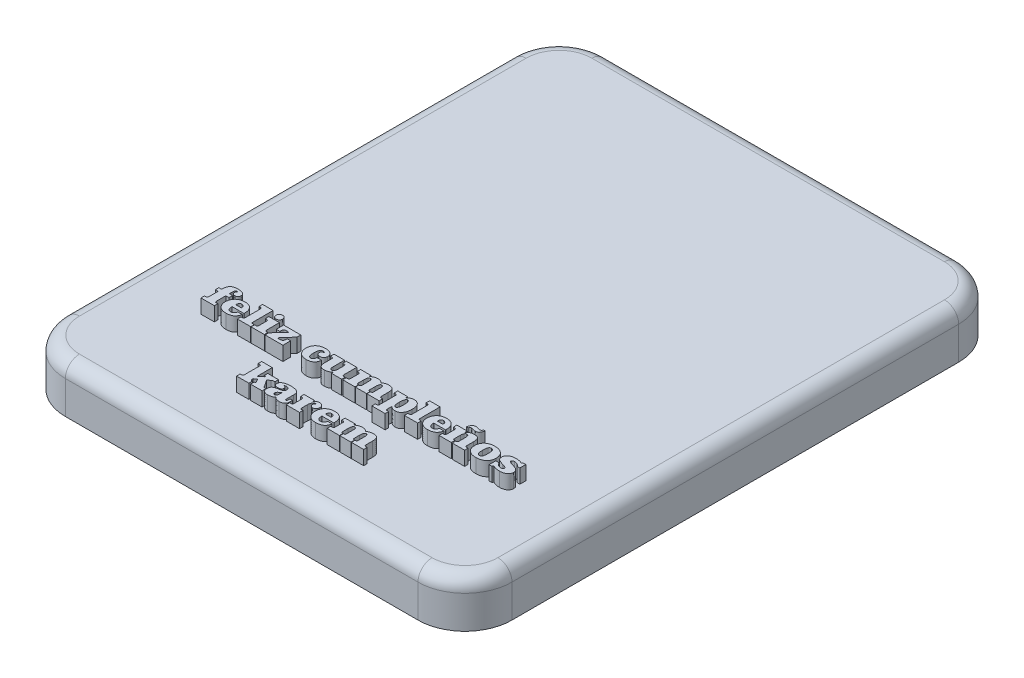
from build123d import *

# Parameters (mm, degrees)
SALIENTE_EXTRUIR1_DEPTH = 10
REDONDEO1_R             = 3
SALIENTE_EXTRUIR3_DEPTH = 3


with BuildPart() as part:
    # Croquis1 → Saliente-Extruir1 (new body)
    with BuildSketch(Plane(origin=(0, 0, 0), x_dir=(1, 0, 0), z_dir=(0, 1, 0))):
        with BuildLine():
            Line((-37.5, -57.5), (37.5, -57.5))
            ThreePointArc((37.5, -57.5), (44.571067812, -54.571067812), (47.5, -47.5))
            Line((47.5, -47.5), (47.5, 47.5))
            ThreePointArc((47.5, 47.5), (44.571067812, 54.571067812), (37.5, 57.5))
            Line((37.5, 57.5), (-37.5, 57.5))
            ThreePointArc((-37.5, 57.5), (-44.571067812, 54.571067812), (-47.5, 47.5))
            Line((-47.5, 47.5), (-47.5, -47.5))
            ThreePointArc((-47.5, -47.5), (-44.571067812, -54.571067812), (-37.5, -57.5))
        make_face()
    extrude(amount=SALIENTE_EXTRUIR1_DEPTH)

    # Redondeo1
    redondeo1_edges = [part.edges().sort_by_distance(p)[0] for p in [
        (44.571067812, 10, 54.571067812),
        (47.5, 10, 0),
        (44.571067812, 10, -54.571067812),
        (0, 10, -57.5),
        (-44.571067812, 10, -54.571067812),
        (-47.5, 10, 0),
        (-44.571067812, 10, 54.571067812),
        (0, 10, 57.5),
    ]]
    fillet(redondeo1_edges, radius=REDONDEO1_R)

    # Croquis2 → Saliente-Extruir3 (add)
    # profile 1 of 21: a face of its own
    with BuildSketch(Plane(origin=(0, 10, 0), x_dir=(1, 0, 0), z_dir=(0, 1, 0))):
        with BuildLine():
            Line((-31.315150818, -31.185581738), (-31.910769549, -31.185581738))
            Line((-31.910769549, -31.185581738), (-31.910769549, -30.441058324))
            Line((-31.910769549, -30.441058324), (-31.315150818, -30.441058324))
            Line((-31.315150818, -30.441058324), (-31.315150818, -30.201414851))
            add(Edge.make_bspline(
                [(-31.315150818, -30.201414851), (-31.313791289, -30.135444174), (-31.311161696, -30.007844063), (-31.291617904, -29.823698727), (-31.258329546, -29.653723118), (-31.210458931, -29.498278309), (-31.150364541, -29.356031968), (-31.075252829, -29.228489103), (-30.987917947, -29.114128589), (-30.88481141, -29.015028957), (-30.766488079, -28.929545417), (-30.633070261, -28.854838221), (-30.483063651, -28.792263588), (-30.317021246, -28.741402634), (-30.134854873, -28.702132835), (-29.936487328, -28.675156568), (-29.722123449, -28.657136394), (-29.573703723, -28.655202877), (-29.496885044, -28.654202132)],
                knots=[0, 0, 0, 0, 1.146523486, 2.217599261, 3.21426236, 4.152317825, 5.039986429, 5.891930971, 6.718351278, 7.533452689, 8.367941695, 9.249112602, 10.185471543, 11.187453369, 12.263585658, 13.42075783, 14.665042849, 16, 16, 16, 16], degree=3))
            add(Edge.make_bspline(
                [(-29.496885044, -28.654202132), (-29.442952492, -28.654617343), (-29.337637855, -28.655428128), (-29.184309454, -28.669115699), (-29.038940199, -28.688383565), (-28.902017691, -28.715975035), (-28.77327632, -28.752087024), (-28.652988207, -28.796254334), (-28.540776187, -28.848604445), (-28.437765931, -28.908860487), (-28.34432149, -28.974953954), (-28.262431096, -29.046484074), (-28.19418849, -29.124956436), (-28.13631943, -29.206838285), (-28.093329929, -29.295594799), (-28.061222515, -29.3883628), (-28.042170263, -29.487134974), (-28.040235359, -29.554915169), (-28.039247799, -29.58950967)],
                knots=[0, 0, 0, 0, 1.341789224, 2.620125341, 3.828032548, 4.99015629, 6.093108227, 7.152644797, 8.1758691, 9.170662378, 10.118664973, 11.021115592, 11.869078827, 12.701634349, 13.508741485, 14.314462631, 15.139714401, 16, 16, 16, 16], degree=3))
            add(Edge.make_bspline(
                [(-28.039247799, -29.58950967), (-28.041579005, -29.633629769), (-28.046105234, -29.719292607), (-28.085223339, -29.841158524), (-28.147847918, -29.950953578), (-28.236153564, -30.044453982), (-28.342525734, -30.121818508), (-28.46529005, -30.17838102), (-28.602951161, -30.21105355), (-28.699060018, -30.215432014), (-28.748871677, -30.2177013)],
                knots=[0, 0, 0, 0, 0.996264083, 1.934329511, 2.866011647, 3.834687785, 4.82112627, 5.826239368, 6.873375172, 8, 8, 8, 8], degree=3))
            add(Edge.make_bspline(
                [(-28.748871677, -30.2177013), (-28.793254741, -30.216133465), (-28.87833335, -30.213128055), (-28.999876824, -30.18400301), (-29.109280835, -30.138002412), (-29.204200448, -30.072455483), (-29.280958754, -29.992186654), (-29.339197882, -29.901068713), (-29.372628388, -29.797635685), (-29.377095405, -29.72546371), (-29.379389943, -29.688391686)],
                knots=[0, 0, 0, 0, 1.155859545, 2.21568573, 3.239625053, 4.235608621, 5.201346915, 6.119071852, 7.03383809, 8, 8, 8, 8], degree=3))
            add(Edge.make_bspline(
                [(-29.379389943, -29.688391686), (-29.378428429, -29.664295215), (-29.376538091, -29.616921494), (-29.363586348, -29.547551413), (-29.341578552, -29.481980978), (-29.309517306, -29.420554213), (-29.268223472, -29.363534565), (-29.219350737, -29.309710885), (-29.161286359, -29.260569025), (-29.118687186, -29.231226813), (-29.09670371, -29.216084646)],
                knots=[0, 0, 0, 0, 1.002616405, 1.97114625, 2.925455142, 3.870991113, 4.842742242, 5.847952743, 6.889427281, 8, 8, 8, 8], degree=3))
            add(Edge.make_bspline(
                [(-29.09670371, -29.216084646), (-29.117143512, -29.209434305), (-29.154602585, -29.197246537), (-29.207887593, -29.186622199), (-29.25337604, -29.176495289), (-29.282010003, -29.175731739), (-29.295631059, -29.175368522)],
                knots=[0, 0, 0, 0, 1.264295748, 2.317015824, 3.199411441, 4, 4, 4, 4], degree=3))
            add(Edge.make_bspline(
                [(-29.295631059, -29.175368522), (-29.327730231, -29.176702637), (-29.38892212, -29.179245913), (-29.472925052, -29.210901358), (-29.543105503, -29.261424067), (-29.595859986, -29.336346115), (-29.633986433, -29.435127044), (-29.658756579, -29.561709871), (-29.674349847, -29.717861042), (-29.676196559, -29.832208943), (-29.677199308, -29.894298943)],
                knots=[0, 0, 0, 0, 0.830135218, 1.582518791, 2.295908392, 3.045588457, 3.926857754, 5.029590006, 6.387091023, 8, 8, 8, 8], degree=3))
            Line((-29.677199308, -29.894298943), (-29.677199308, -30.441058324))
            Line((-29.677199308, -30.441058324), (-29.007128236, -30.441058324))
            Line((-29.007128236, -30.441058324), (-29.007128236, -31.185581738))
            Line((-29.007128236, -31.185581738), (-29.677199308, -31.185581738))
            Line((-29.677199308, -31.185581738), (-29.677199308, -33.113199388))
            add(Edge.make_bspline(
                [(-29.677199308, -33.113199388), (-29.676434338, -33.148925973), (-29.675047893, -33.213677491), (-29.662591269, -33.301297516), (-29.643429097, -33.36981938), (-29.612813393, -33.422621662), (-29.564281332, -33.457933769), (-29.499302651, -33.477643696), (-29.418008162, -33.491838421), (-29.35776143, -33.492978788), (-29.324714005, -33.493604319)],
                knots=[0, 0, 0, 0, 1.380680399, 2.502370498, 3.412893014, 4.120122307, 4.81581469, 5.674103506, 6.724165015, 8, 8, 8, 8], degree=3))
            Line((-29.324714005, -33.493604319), (-29.081580578, -33.493604319))
            Line((-29.081580578, -33.493604319), (-29.081580578, -34.238127733))
            Line((-29.081580578, -34.238127733), (-31.910769549, -34.238127733))
            Line((-31.910769549, -34.238127733), (-31.910769549, -33.493604319))
            Line((-31.910769549, -33.493604319), (-31.707188928, -33.493604319))
            add(Edge.make_bspline(
                [(-31.707188928, -33.493604319), (-31.670306972, -33.492815975), (-31.603254455, -33.491382742), (-31.512861248, -33.479176107), (-31.442312032, -33.459926198), (-31.387882457, -33.428291033), (-31.353759734, -33.376437271), (-31.329898969, -33.309769361), (-31.317303607, -33.223375553), (-31.315913897, -33.159762193), (-31.315150818, -33.124832566)],
                knots=[0, 0, 0, 0, 1.37061587, 2.491821342, 3.380991446, 4.080812997, 4.772871783, 5.634990337, 6.701390605, 8, 8, 8, 8], degree=3))
            Line((-31.315150818, -33.124832566), (-31.315150818, -31.185581738))
        make_face()
    # profile 2 of 21: a face of its own
    with BuildSketch(Plane(origin=(0, 10, 0), x_dir=(1, 0, 0), z_dir=(0, 1, 0))):
        with BuildLine():
            add(Edge.make_bspline(
                [(-24.465535415, -32.897985589), (-24.477732225, -32.958713142), (-24.501577655, -33.077438826), (-24.553232155, -33.247862237), (-24.615910994, -33.406212053), (-24.689359436, -33.553605844), (-24.77572462, -33.687705214), (-24.87098265, -33.812052545), (-24.980839022, -33.921020105), (-25.099200684, -34.021232157), (-25.231252564, -34.106968446), (-25.373408444, -34.183807063), (-25.529036184, -34.245169561), (-25.694949984, -34.298854431), (-25.873281311, -34.336889314), (-26.0627346, -34.36644404), (-26.264087637, -34.383862734), (-26.402426253, -34.385957418), (-26.473421995, -34.387032415)],
                knots=[0, 0, 0, 0, 1.074883391, 2.101455722, 3.086573179, 4.028942088, 4.955254846, 5.852159633, 6.742369115, 7.636236799, 8.539962828, 9.470595676, 10.436970722, 11.439802905, 12.494961599, 13.598494153, 14.767540859, 16, 16, 16, 16], degree=3))
            add(Edge.make_bspline(
                [(-26.473421995, -34.387032415), (-26.554549554, -34.385764096), (-26.713008242, -34.383286808), (-26.944025832, -34.355378627), (-27.162303815, -34.312698285), (-27.368264271, -34.254330874), (-27.559887754, -34.175337324), (-27.739238541, -34.081091428), (-27.905319012, -33.969052994), (-28.05663317, -33.839416735), (-28.19262119, -33.695709005), (-28.311114346, -33.538390477), (-28.411621954, -33.36917718), (-28.493296941, -33.187146393), (-28.557647897, -32.993120507), (-28.602463175, -32.786443287), (-28.629531834, -32.567935796), (-28.633061587, -32.418390037), (-28.63486653, -32.341919664)],
                knots=[0, 0, 0, 0, 1.156312456, 2.258514327, 3.312575887, 4.325802086, 5.305397023, 6.262654653, 7.210442992, 8.15566321, 9.098356963, 10.026208851, 10.958400359, 11.898820993, 12.865787222, 13.867984346, 14.909791674, 16, 16, 16, 16], degree=3))
            add(Edge.make_bspline(
                [(-28.63486653, -32.341919664), (-28.633064032, -32.265835821), (-28.629539407, -32.117060569), (-28.602443283, -31.899721993), (-28.557728239, -31.694159927), (-28.492788754, -31.500765257), (-28.411884924, -31.318454342), (-28.311276205, -31.148493976), (-28.190941289, -30.992008099), (-28.055670893, -30.846161903), (-27.902834558, -30.716867423), (-27.738589781, -30.601469428), (-27.560210961, -30.505848439), (-27.369635391, -30.428358452), (-27.167488997, -30.365630433), (-26.952114364, -30.324051813), (-26.724673503, -30.295826253), (-26.568517783, -30.293397493), (-26.488545127, -30.292153642)],
                knots=[0, 0, 0, 0, 1.08939574, 2.130217366, 3.131345753, 4.097242782, 5.046813071, 5.983054421, 6.918290503, 7.869126648, 8.826283074, 9.779888485, 10.739024521, 11.717736454, 12.722570203, 13.764872372, 14.855315105, 16, 16, 16, 16], degree=3))
            add(Edge.make_bspline(
                [(-26.488545127, -30.292153642), (-26.410135482, -30.293506718), (-26.257525975, -30.296140225), (-26.035787995, -30.322601988), (-25.827610578, -30.363590753), (-25.633369726, -30.422976524), (-25.45345307, -30.499669122), (-25.287942649, -30.593801274), (-25.13539404, -30.703311699), (-24.998069497, -30.830792628), (-24.875158949, -30.97332815), (-24.768473042, -31.131244027), (-24.680567039, -31.304988216), (-24.606869695, -31.491800132), (-24.549766452, -31.693663605), (-24.509893563, -31.910201514), (-24.484990287, -32.141248258), (-24.482128119, -32.299974757), (-24.480658547, -32.381472471)],
                knots=[0, 0, 0, 0, 1.139188137, 2.217213728, 3.240763115, 4.219526117, 5.163848219, 6.077549891, 6.981728026, 7.887117431, 8.794329465, 9.711934046, 10.649639668, 11.618813758, 12.626804757, 13.693529404, 14.815748586, 16, 16, 16, 16], degree=3))
            Line((-24.480658547, -32.381472471), (-24.480658547, -32.525723882))
            Line((-24.480658547, -32.525723882), (-26.99691502, -32.525723882))
            Line((-26.99691502, -32.525723882), (-26.99691502, -32.608319448))
            add(Edge.make_bspline(
                [(-26.99691502, -32.608319448), (-26.996218838, -32.648671221), (-26.99486473, -32.727157399), (-26.98515285, -32.841291127), (-26.971223977, -32.948932149), (-26.947015786, -33.048422885), (-26.919926161, -33.141520935), (-26.884543899, -33.22653848), (-26.844086117, -33.30531163), (-26.796313411, -33.376228661), (-26.743049837, -33.439313358), (-26.683663624, -33.493488439), (-26.619934125, -33.540707126), (-26.549371886, -33.57765814), (-26.474461823, -33.606887799), (-26.39456916, -33.628307148), (-26.308926707, -33.639368348), (-26.25009256, -33.641441986), (-26.219818708, -33.642509002)],
                knots=[0, 0, 0, 0, 1.321312732, 2.570018128, 3.749992399, 4.871307272, 5.919855267, 6.922162427, 7.882141543, 8.815544038, 9.716413745, 10.579242415, 11.442911822, 12.306487853, 13.179074711, 14.072393591, 15.00812582, 16, 16, 16, 16], degree=3))
            add(Edge.make_bspline(
                [(-26.219818708, -33.642509002), (-26.169173021, -33.640545742), (-26.071136712, -33.636745405), (-25.9311203, -33.599579006), (-25.805641572, -33.538477195), (-25.695440097, -33.452727745), (-25.601641726, -33.344310167), (-25.526396993, -33.213972739), (-25.465582254, -33.06418003), (-25.44217843, -32.955094695), (-25.429925899, -32.897985589)],
                knots=[0, 0, 0, 0, 1.017644018, 1.969882752, 2.891398603, 3.809370978, 4.760937758, 5.758173919, 6.826343761, 8, 8, 8, 8], degree=3))
            Line((-25.429925899, -32.897985589), (-24.465535415, -32.897985589))
        make_face()
        with BuildLine():
            Line((-26.99691502, -31.781200469), (-25.805677559, -31.781200469))
            Line((-25.805677559, -31.781200469), (-25.805677559, -31.728851166))
            add(Edge.make_bspline(
                [(-25.805677559, -31.728851166), (-25.806977844, -31.676309724), (-25.8094399, -31.57682392), (-25.840692053, -31.437438477), (-25.888520991, -31.315945713), (-25.958793944, -31.215146051), (-26.045751172, -31.13379334), (-26.151981053, -31.076949683), (-26.274347403, -31.042741984), (-26.361508554, -31.03876033), (-26.407112879, -31.036677055)],
                knots=[0, 0, 0, 0, 1.208799935, 2.288830076, 3.274812217, 4.199665979, 5.097963363, 5.993945314, 6.950395138, 8, 8, 8, 8], degree=3))
            add(Edge.make_bspline(
                [(-26.407112879, -31.036677055), (-26.451631437, -31.038473036), (-26.537365909, -31.041931761), (-26.657454095, -31.080795525), (-26.76222474, -31.14231448), (-26.848253936, -31.229896478), (-26.916336314, -31.338666934), (-26.963440397, -31.468668405), (-26.992761242, -31.61819183), (-26.99547838, -31.72482175), (-26.99691502, -31.781200469)],
                knots=[0, 0, 0, 0, 0.989892863, 1.90634974, 2.783083043, 3.676093857, 4.616844486, 5.624195273, 6.743834524, 8, 8, 8, 8], degree=3))
        make_face(mode=Mode.SUBTRACT)
    # profile 3 of 21: a face of its own
    with BuildSketch(Plane(origin=(0, 10, 0), x_dir=(1, 0, 0), z_dir=(0, 1, 0))):
        with BuildLine():
            add(Edge.make_bspline(
                [(-23.572107319, -29.988527687), (-23.572719519, -29.95395231), (-23.573834483, -29.890982229), (-23.588110053, -29.805886716), (-23.612626442, -29.739538263), (-23.650549159, -29.689589264), (-23.706091385, -29.656887506), (-23.779010313, -29.636212725), (-23.871868878, -29.624438653), (-23.940454027, -29.622917589), (-23.978105243, -29.62208257)],
                knots=[0, 0, 0, 0, 1.269504598, 2.312073363, 3.156180889, 3.846078898, 4.569593906, 5.48001558, 6.616603198, 8, 8, 8, 8], degree=3))
            Line((-23.978105243, -29.62208257), (-24.167726049, -29.62208257))
            Line((-24.167726049, -29.62208257), (-24.167726049, -28.877559156))
            Line((-24.167726049, -28.877559156), (-21.934155809, -28.877559156))
            Line((-21.934155809, -28.877559156), (-21.934155809, -33.127159202))
            add(Edge.make_bspline(
                [(-21.934155809, -33.127159202), (-21.933227061, -33.162149701), (-21.931542565, -33.225612961), (-21.915574257, -33.311346503), (-21.890573699, -33.378709962), (-21.849522977, -33.429338637), (-21.7880938, -33.460254692), (-21.70794742, -33.478991698), (-21.605690424, -33.491427593), (-21.530139649, -33.492832153), (-21.488605079, -33.493604319)],
                knots=[0, 0, 0, 0, 1.217008097, 2.207322101, 3.024692249, 3.695432487, 4.420627304, 5.370349588, 6.554331187, 8, 8, 8, 8], degree=3))
            Line((-21.488605079, -33.493604319), (-21.338537079, -33.493604319))
            Line((-21.338537079, -33.493604319), (-21.338537079, -34.238127733))
            Line((-21.338537079, -34.238127733), (-24.167726049, -34.238127733))
            Line((-24.167726049, -34.238127733), (-24.167726049, -33.493604319))
            Line((-24.167726049, -33.493604319), (-23.978105243, -33.493604319))
            add(Edge.make_bspline(
                [(-23.978105243, -33.493604319), (-23.940467418, -33.492750207), (-23.871906663, -33.491194363), (-23.77889984, -33.479631675), (-23.706584735, -33.458432297), (-23.649784268, -33.427376954), (-23.613075763, -33.376124577), (-23.587986503, -33.309913299), (-23.573876599, -33.224666097), (-23.572734447, -33.16172091), (-23.572107319, -33.127159202)],
                knots=[0, 0, 0, 0, 1.3827462, 2.518799289, 3.428792798, 4.144495218, 4.845303441, 5.689013988, 6.731092441, 8, 8, 8, 8], degree=3))
            Line((-23.572107319, -33.127159202), (-23.572107319, -29.988527687))
        make_face()
    # profile 4 of 21: a face of its own
    with BuildSketch(Plane(origin=(0, 10, 0), x_dir=(1, 0, 0), z_dir=(0, 1, 0))):
        with BuildLine():
            add(Edge.make_bspline(
                [(-20.742918348, -29.438278352), (-20.74063502, -29.390294336), (-20.736175066, -29.296568658), (-20.695786791, -29.162033275), (-20.631235303, -29.038987674), (-20.541111657, -28.931564369), (-20.433637395, -28.842073694), (-20.312282462, -28.775498975), (-20.178464293, -28.735488773), (-20.08552908, -28.730968686), (-20.037947741, -28.728654474)],
                knots=[0, 0, 0, 0, 1.032498145, 2.016746362, 3.000390691, 4.009883735, 5.01937678, 5.999603937, 6.975829274, 8, 8, 8, 8], degree=3))
            add(Edge.make_bspline(
                [(-20.037947741, -28.728654474), (-19.990341792, -28.730889575), (-19.896875127, -28.735277839), (-19.762965813, -28.776731004), (-19.640589526, -28.843405941), (-19.532385344, -28.933895148), (-19.441993882, -29.042103103), (-19.375171868, -29.163944647), (-19.335157237, -29.297761532), (-19.330637762, -29.390696922), (-19.328323862, -29.438278352)],
                knots=[0, 0, 0, 0, 1.022358945, 2.00723823, 2.985731342, 4.005190456, 5.024649569, 6.003142682, 6.977641055, 8, 8, 8, 8], degree=3))
            add(Edge.make_bspline(
                [(-19.328323862, -29.438278352), (-19.330666631, -29.485470296), (-19.335260798, -29.578013669), (-19.375212109, -29.711421698), (-19.441693437, -29.833130196), (-19.532425852, -29.940466672), (-19.640980322, -30.029482818), (-19.762716376, -30.096718745), (-19.897106316, -30.136245985), (-19.990382564, -30.140883904), (-20.037947741, -30.143248959)],
                knots=[0, 0, 0, 0, 1.016894426, 1.994129361, 2.975370252, 3.991265341, 5.008263091, 5.989503983, 6.974770093, 8, 8, 8, 8], degree=3))
            add(Edge.make_bspline(
                [(-20.037947741, -30.143248959), (-20.085896861, -30.140843463), (-20.179447057, -30.136150266), (-20.313867914, -30.097698729), (-20.436169341, -30.033533398), (-20.543323952, -29.945294683), (-20.632435939, -29.83870389), (-20.69608192, -29.715977973), (-20.736163873, -29.581127567), (-20.740631296, -29.486646807), (-20.742918348, -29.438278352)],
                knots=[0, 0, 0, 0, 1.033254615, 2.01591127, 2.988974516, 3.993891862, 4.992344403, 5.965407648, 6.958411327, 8, 8, 8, 8], degree=3))
        make_face()
    # profile 5 of 21: a face of its own
    with BuildSketch(Plane(origin=(0, 10, 0), x_dir=(1, 0, 0), z_dir=(0, 1, 0))):
        with BuildLine():
            add(Edge.make_bspline(
                [(-19.030514497, -33.12832252), (-19.029323696, -33.162472958), (-19.027144444, -33.224970739), (-19.013865819, -33.310202458), (-18.987143541, -33.37622785), (-18.948947379, -33.428238334), (-18.888047625, -33.458596601), (-18.810096308, -33.479735538), (-18.709341707, -33.491150094), (-18.635001791, -33.492735604), (-18.59427031, -33.493604319)],
                knots=[0, 0, 0, 0, 1.207345494, 2.209529867, 3.026126747, 3.708543835, 4.432324058, 5.373090772, 6.560693755, 8, 8, 8, 8], degree=3))
            Line((-18.59427031, -33.493604319), (-18.434895766, -33.493604319))
            Line((-18.434895766, -33.493604319), (-18.434895766, -34.238127733))
            Line((-18.434895766, -34.238127733), (-21.264084737, -34.238127733))
            Line((-21.264084737, -34.238127733), (-21.264084737, -33.493604319))
            Line((-21.264084737, -33.493604319), (-21.095403651, -33.493604319))
            add(Edge.make_bspline(
                [(-21.095403651, -33.493604319), (-21.055445069, -33.492734841), (-20.982645433, -33.491150759), (-20.884208647, -33.479803365), (-20.808103972, -33.458503274), (-20.748822004, -33.427820338), (-20.71036932, -33.376518067), (-20.685891815, -33.309729654), (-20.669788164, -33.225231509), (-20.668932763, -33.162533994), (-20.668466007, -33.12832252)],
                knots=[0, 0, 0, 0, 1.429096846, 2.603639153, 3.529228843, 4.249771146, 4.940484862, 5.761760378, 6.778683985, 8, 8, 8, 8], degree=3))
            Line((-20.668466007, -33.12832252), (-20.668466007, -31.550863538))
            add(Edge.make_bspline(
                [(-20.668466007, -31.550863538), (-20.668938467, -31.516259471), (-20.669805117, -31.452784187), (-20.685820626, -31.367569768), (-20.709989355, -31.300388082), (-20.749296256, -31.250266833), (-20.807855976, -31.219224025), (-20.884489603, -31.19990298), (-20.982585658, -31.187851862), (-21.055423886, -31.186386211), (-21.095403651, -31.185581738)],
                knots=[0, 0, 0, 0, 1.233190818, 2.262079128, 3.082041223, 3.760869043, 4.480259023, 5.400524705, 6.57318863, 8, 8, 8, 8], degree=3))
            Line((-21.095403651, -31.185581738), (-21.264084737, -31.185581738))
            Line((-21.264084737, -31.185581738), (-21.264084737, -30.441058324))
            Line((-21.264084737, -30.441058324), (-19.030514497, -30.441058324))
            Line((-19.030514497, -30.441058324), (-19.030514497, -33.12832252))
        make_face()
    # profile 6 of 21: a face of its own
    with BuildSketch(Plane(origin=(0, 10, 0), x_dir=(1, 0, 0), z_dir=(0, 1, 0))):
        with BuildLine():
            Line((-18.285991084, -34.238127733), (-18.285991084, -33.465684691))
            Line((-18.285991084, -33.465684691), (-16.233898426, -31.185581738))
            Line((-16.233898426, -31.185581738), (-16.753901497, -31.185581738))
            add(Edge.make_bspline(
                [(-16.753901497, -31.185581738), (-16.782994952, -31.186022312), (-16.838945842, -31.1868696), (-16.919527855, -31.193456435), (-16.992649261, -31.206214702), (-17.058547864, -31.223521539), (-17.117047899, -31.245670676), (-17.1690702, -31.271829954), (-17.212536791, -31.305168366), (-17.249916881, -31.343210553), (-17.281290716, -31.389687281), (-17.30740431, -31.446018499), (-17.330456521, -31.512725017), (-17.350078404, -31.590181298), (-17.365948541, -31.678450864), (-17.378515279, -31.777471819), (-17.387838321, -31.887309028), (-17.390937193, -31.964211395), (-17.392562988, -32.004557493)],
                knots=[0, 0, 0, 0, 1.143717449, 2.199532824, 3.174443389, 4.058209571, 4.87359332, 5.630446404, 6.337781387, 7.016959025, 7.718852254, 8.530236199, 9.451088663, 10.490041855, 11.668089953, 12.974647626, 14.41277756, 16, 16, 16, 16], degree=3))
            Line((-17.392562988, -32.004557493), (-18.137086401, -32.004557493))
            Line((-18.137086401, -32.004557493), (-18.137086401, -30.441058324))
            Line((-18.137086401, -30.441058324), (-14.488921675, -30.441058324))
            Line((-14.488921675, -30.441058324), (-14.488921675, -31.213501366))
            Line((-14.488921675, -31.213501366), (-16.480521806, -33.493604319))
            Line((-16.480521806, -33.493604319), (-15.957028781, -33.493604319))
            add(Edge.make_bspline(
                [(-15.957028781, -33.493604319), (-15.924045987, -33.493317551), (-15.8606834, -33.492766645), (-15.769420239, -33.484145388), (-15.686169993, -33.47189359), (-15.610500324, -33.454571201), (-15.54331431, -33.43175712), (-15.484155992, -33.403303204), (-15.432202978, -33.371090894), (-15.387899896, -33.331907468), (-15.351523632, -33.284662029), (-15.318502971, -33.231284231), (-15.29184031, -33.168022379), (-15.270084312, -33.096672489), (-15.254473157, -33.016249857), (-15.241193278, -32.928230226), (-15.234745107, -32.830996083), (-15.233891179, -32.763434999), (-15.233445089, -32.728141185)],
                knots=[0, 0, 0, 0, 1.274714152, 2.448827912, 3.540812199, 4.526333075, 5.446143871, 6.277652692, 7.059565176, 7.802866035, 8.549786887, 9.357157047, 10.223354418, 11.195556832, 12.236428565, 13.387730565, 14.635354173, 16, 16, 16, 16], degree=3))
            Line((-15.233445089, -32.728141185), (-15.233445089, -32.600176223))
            Line((-15.233445089, -32.600176223), (-14.488921675, -32.600176223))
            Line((-14.488921675, -32.600176223), (-14.488921675, -34.238127733))
            Line((-14.488921675, -34.238127733), (-18.285991084, -34.238127733))
        make_face()
    # profile 7 of 21: a face of its own
    with BuildSketch(Plane(origin=(0, 10, 0), x_dir=(1, 0, 0), z_dir=(0, 1, 0))):
        with BuildLine():
            add(Edge.make_bspline(
                [(-7.639306272, -32.897985589), (-7.642573348, -32.956631887), (-7.648919889, -33.070556725), (-7.674807443, -33.236118984), (-7.713947265, -33.390857435), (-7.766908879, -33.535314035), (-7.831451445, -33.669839793), (-7.911461885, -33.793139739), (-8.005220642, -33.905154964), (-8.111373866, -34.007118916), (-8.230723912, -34.096199675), (-8.36062316, -34.175532245), (-8.503872056, -34.239696375), (-8.657580757, -34.295012713), (-8.823255059, -34.336534928), (-9.000410129, -34.364740118), (-9.188796765, -34.384351269), (-9.31869594, -34.386122332), (-9.38544634, -34.387032415)],
                knots=[0, 0, 0, 0, 1.085090483, 2.10786973, 3.09173985, 4.030430307, 4.947167017, 5.843734524, 6.73935621, 7.641663224, 8.557615152, 9.486845868, 10.448938954, 11.453168589, 12.503084601, 13.600039494, 14.766748733, 16, 16, 16, 16], degree=3))
            add(Edge.make_bspline(
                [(-9.38544634, -34.387032415), (-9.464641636, -34.385766655), (-9.619632938, -34.383289466), (-9.845172149, -34.355276202), (-10.058948701, -34.313392848), (-10.259544858, -34.25078487), (-10.448800117, -34.173668153), (-10.625181148, -34.077271659), (-10.788135424, -33.96275338), (-10.938536193, -33.832466961), (-11.073333176, -33.687506217), (-11.190247545, -33.529187303), (-11.290071817, -33.359878166), (-11.370103351, -33.177543731), (-11.434847359, -32.984705439), (-11.478173436, -32.778942747), (-11.505578415, -32.562142201), (-11.509051753, -32.413355892), (-11.510828022, -32.337266393)],
                knots=[0, 0, 0, 0, 1.139151356, 2.229407071, 3.265887778, 4.27032159, 5.248680527, 6.202718296, 7.156429552, 8.109830517, 9.061531256, 9.99912071, 10.937125302, 11.883986673, 12.859923216, 13.85932115, 14.905254244, 16, 16, 16, 16], degree=3))
            add(Edge.make_bspline(
                [(-11.510828022, -32.337266393), (-11.50903683, -32.260407577), (-11.505542599, -32.110472513), (-11.478425488, -31.891578464), (-11.433604899, -31.684905625), (-11.369274776, -31.490864326), (-11.287524352, -31.308888938), (-11.18717456, -31.139270121), (-11.067641555, -30.982771681), (-10.931057, -30.839300245), (-10.779030157, -30.710514026), (-10.612700569, -30.597725317), (-10.43230165, -30.503882034), (-10.239882831, -30.425060156), (-10.033621242, -30.366465889), (-9.814956824, -30.323706528), (-9.583147177, -30.29591654), (-9.423917692, -30.293427733), (-9.34240358, -30.292153642)],
                knots=[0, 0, 0, 0, 1.093676357, 2.133527983, 3.133843763, 4.098994783, 5.037650039, 5.968091619, 6.897534158, 7.834451659, 8.782101521, 9.728110652, 10.688452497, 11.671319927, 12.682644077, 13.734726931, 14.840342161, 16, 16, 16, 16], degree=3))
            add(Edge.make_bspline(
                [(-9.34240358, -30.292153642), (-9.279164805, -30.293324738), (-9.155960791, -30.29560631), (-8.975911636, -30.311764258), (-8.805748471, -30.339903462), (-8.644770063, -30.377509716), (-8.494316629, -30.42789033), (-8.353401795, -30.488279386), (-8.22288147, -30.560975605), (-8.101855704, -30.642712938), (-7.994205149, -30.734768516), (-7.898431157, -30.832858439), (-7.817784795, -30.939050422), (-7.752295572, -31.052466082), (-7.701496316, -31.172859144), (-7.66604071, -31.299920502), (-7.642680548, -31.434064793), (-7.640448556, -31.525944545), (-7.639306272, -31.572966576)],
                knots=[0, 0, 0, 0, 1.27036316, 2.474966353, 3.627566786, 4.732892582, 5.792157318, 6.810947856, 7.808186355, 8.789135678, 9.739704154, 10.648731143, 11.538358556, 12.410870522, 13.273168317, 14.155948126, 15.056254908, 16, 16, 16, 16], degree=3))
            add(Edge.make_bspline(
                [(-7.639306272, -31.572966576), (-7.639977935, -31.604013071), (-7.641291685, -31.664738962), (-7.651481765, -31.753274732), (-7.670232587, -31.836210078), (-7.696009526, -31.913737346), (-7.728387893, -31.986081754), (-7.768232228, -32.052803877), (-7.814978373, -32.114215152), (-7.870110073, -32.168435932), (-7.931007704, -32.217966705), (-7.998533556, -32.260875233), (-8.072263476, -32.29715342), (-8.152040672, -32.325876353), (-8.237470927, -32.34959913), (-8.329430883, -32.365462714), (-8.427459695, -32.374644034), (-8.494712473, -32.376081243), (-8.529244415, -32.376819199)],
                knots=[0, 0, 0, 0, 1.091924724, 2.135767706, 3.128455199, 4.077354758, 5.005239939, 5.91049408, 6.805309985, 7.711898931, 8.623603531, 9.5619556, 10.519636936, 11.507816459, 12.54019026, 13.634497615, 14.785397537, 16, 16, 16, 16], degree=3))
            add(Edge.make_bspline(
                [(-8.529244415, -32.376819199), (-8.584076136, -32.374937227), (-8.688457094, -32.371354592), (-8.836376556, -32.341011902), (-8.966830143, -32.290226922), (-9.077284268, -32.2171821), (-9.168158878, -32.127298541), (-9.231610803, -32.018863751), (-9.270683999, -31.895875629), (-9.27500452, -31.809038487), (-9.277257782, -31.763750701)],
                knots=[0, 0, 0, 0, 1.205688211, 2.295220518, 3.306228697, 4.267160607, 5.190409293, 6.093401138, 7.005660029, 8, 8, 8, 8], degree=3))
            add(Edge.make_bspline(
                [(-9.277257782, -31.763750701), (-9.275624337, -31.725951537), (-9.272476262, -31.653102699), (-9.243794855, -31.549065051), (-9.195548093, -31.457177343), (-9.129194587, -31.378023388), (-9.046600258, -31.313000693), (-8.948407807, -31.265784963), (-8.837131675, -31.233220426), (-8.757882995, -31.227142243), (-8.716538586, -31.223971226)],
                knots=[0, 0, 0, 0, 1.039435048, 2.003262145, 2.944337321, 3.876890296, 4.827611594, 5.816264845, 6.860735096, 8, 8, 8, 8], degree=3))
            add(Edge.make_bspline(
                [(-8.716538586, -31.223971226), (-8.737751392, -31.194062393), (-8.778961128, -31.135959041), (-8.869867553, -31.075467699), (-8.979996254, -31.040315336), (-9.060180489, -31.03796127), (-9.103923424, -31.036677055)],
                knots=[0, 0, 0, 0, 0.966873316, 1.878327341, 2.842563126, 4, 4, 4, 4], degree=3))
            add(Edge.make_bspline(
                [(-9.103923424, -31.036677055), (-9.134594728, -31.037624587), (-9.193507797, -31.039444594), (-9.278930411, -31.051856834), (-9.356943411, -31.075451972), (-9.428461397, -31.107010195), (-9.493987764, -31.146216002), (-9.549690314, -31.197894343), (-9.600631644, -31.256185391), (-9.644106407, -31.325366997), (-9.68143589, -31.405480298), (-9.712603575, -31.498873872), (-9.73883498, -31.605932457), (-9.760645626, -31.72717923), (-9.777806158, -31.862698623), (-9.790545165, -32.012100025), (-9.797156788, -32.17589215), (-9.79798951, -32.289564996), (-9.798424171, -32.348899571)],
                knots=[0, 0, 0, 0, 0.872129595, 1.675175997, 2.446093606, 3.181585604, 3.89450106, 4.605025322, 5.332122821, 6.090641358, 6.919242048, 7.839722004, 8.885285094, 10.050914707, 11.340520181, 12.76797005, 14.312955729, 16, 16, 16, 16], degree=3))
            add(Edge.make_bspline(
                [(-9.798424171, -32.348899571), (-9.798022903, -32.40513564), (-9.797250473, -32.513388717), (-9.790118899, -32.669739584), (-9.779129439, -32.813398443), (-9.762239078, -32.944430956), (-9.743866365, -33.063293147), (-9.717567165, -33.169046133), (-9.689709901, -33.263117668), (-9.654148882, -33.344310767), (-9.61446657, -33.415166877), (-9.569394341, -33.476937594), (-9.515795037, -33.526786262), (-9.45865226, -33.569745007), (-9.394909036, -33.602535226), (-9.325501791, -33.625798618), (-9.250305749, -33.640056674), (-9.198216635, -33.641675477), (-9.171395859, -33.642509002)],
                knots=[0, 0, 0, 0, 1.672990416, 3.220466207, 4.655669767, 5.957843278, 7.150825374, 8.230915766, 9.197873089, 10.065895064, 10.861513916, 11.611403807, 12.329469125, 13.030938746, 13.73269292, 14.451406687, 15.202626564, 16, 16, 16, 16], degree=3))
            add(Edge.make_bspline(
                [(-9.171395859, -33.642509002), (-9.130426981, -33.640009488), (-9.051048388, -33.635166594), (-8.93830001, -33.598731544), (-8.84128451, -33.534087064), (-8.75894067, -33.446563578), (-8.694454051, -33.336330587), (-8.645054889, -33.207654893), (-8.615431216, -33.059023082), (-8.610032555, -32.953572643), (-8.60718671, -32.897985589)],
                knots=[0, 0, 0, 0, 0.937749814, 1.816922164, 2.676721811, 3.581500679, 4.54575648, 5.583318909, 6.726072793, 8, 8, 8, 8], degree=3))
            Line((-8.60718671, -32.897985589), (-7.639306272, -32.897985589))
        make_face()
    # profile 8 of 21: a face of its own
    with BuildSketch(Plane(origin=(0, 10, 0), x_dir=(1, 0, 0), z_dir=(0, 1, 0))):
        with BuildLine():
            add(Edge.make_bspline(
                [(-4.173782446, -33.761167421), (-4.21651414, -33.810297468), (-4.300938547, -33.90736301), (-4.445728578, -34.033769596), (-4.602689152, -34.14112129), (-4.770194123, -34.23107191), (-4.948271549, -34.301134939), (-5.135479356, -34.351496294), (-5.33230777, -34.380659317), (-5.46652072, -34.3848821), (-5.534864312, -34.387032415)],
                knots=[0, 0, 0, 0, 1.007249718, 1.990009104, 2.965903748, 3.946312822, 4.927438603, 5.922156179, 6.941925424, 8, 8, 8, 8], degree=3))
            add(Edge.make_bspline(
                [(-5.534864312, -34.387032415), (-5.591517043, -34.386312726), (-5.700390641, -34.384929649), (-5.857504538, -34.369581367), (-6.001524277, -34.344558855), (-6.133007398, -34.309310269), (-6.252606644, -34.266449689), (-6.35799248, -34.209701621), (-6.450997686, -34.144464812), (-6.532050969, -34.06840388), (-6.601977166, -33.979696642), (-6.659677685, -33.875418063), (-6.70972815, -33.757713671), (-6.749769805, -33.624936832), (-6.782817342, -33.4781106), (-6.803455803, -33.315689564), (-6.818042488, -33.139058443), (-6.81954947, -33.016290455), (-6.820330517, -32.952661527)],
                knots=[0, 0, 0, 0, 1.208170366, 2.321827232, 3.363578368, 4.322706531, 5.223105345, 6.06685297, 6.867874795, 7.640325252, 8.42968725, 9.266921866, 10.174963821, 11.153514508, 12.221216099, 13.38172107, 14.642982718, 16, 16, 16, 16], degree=3))
            Line((-6.820330517, -32.952661527), (-6.820330517, -31.550863538))
            add(Edge.make_bspline(
                [(-6.820330517, -31.550863538), (-6.821388865, -31.516293112), (-6.823329725, -31.452895876), (-6.838127734, -31.36703532), (-6.865431273, -31.300007063), (-6.90723314, -31.250162905), (-6.968655371, -31.218857668), (-7.048889512, -31.200222052), (-7.151114314, -31.187748963), (-7.226670396, -31.186350534), (-7.268207883, -31.185581738)],
                knots=[0, 0, 0, 0, 1.203319556, 2.206716642, 3.016778633, 3.696176672, 4.421246115, 5.370804209, 6.554581118, 8, 8, 8, 8], degree=3))
            Line((-7.268207883, -31.185581738), (-7.415949248, -31.185581738))
            Line((-7.415949248, -31.185581738), (-7.415949248, -30.441058324))
            Line((-7.415949248, -30.441058324), (-5.182379008, -30.441058324))
            Line((-5.182379008, -30.441058324), (-5.182379008, -32.877045868))
            add(Edge.make_bspline(
                [(-5.182379008, -32.877045868), (-5.181316328, -32.937627002), (-5.179333314, -33.050674374), (-5.158014256, -33.208069416), (-5.126642501, -33.342223931), (-5.077645743, -33.451883121), (-5.014265332, -33.538820858), (-4.93298244, -33.598267902), (-4.838623337, -33.637281866), (-4.770198413, -33.640716946), (-4.734501642, -33.642509002)],
                knots=[0, 0, 0, 0, 1.454997184, 2.715096175, 3.811416684, 4.753983026, 5.585347089, 6.364502495, 7.1467732, 8, 8, 8, 8], degree=3))
            add(Edge.make_bspline(
                [(-4.734501642, -33.642509002), (-4.696032443, -33.639708507), (-4.620620096, -33.63421861), (-4.514696825, -33.586840267), (-4.424322832, -33.508908985), (-4.348941069, -33.402619), (-4.288357316, -33.272056531), (-4.244498057, -33.119067558), (-4.219797324, -32.945315996), (-4.216325527, -32.822838507), (-4.214498571, -32.758387449)],
                knots=[0, 0, 0, 0, 0.808221819, 1.584381908, 2.396687035, 3.297704605, 4.31071347, 5.418009244, 6.641284723, 8, 8, 8, 8], degree=3))
            Line((-4.214498571, -32.758387449), (-4.214498571, -31.550863538))
            add(Edge.make_bspline(
                [(-4.214498571, -31.550863538), (-4.215063837, -31.515495315), (-4.21608925, -31.451336205), (-4.230763951, -31.364904925), (-4.254251613, -31.297282832), (-4.294176987, -31.248178199), (-4.351773514, -31.218289109), (-4.426524402, -31.198442453), (-4.522910359, -31.18834005), (-4.59411208, -31.186560816), (-4.633292991, -31.185581738)],
                knots=[0, 0, 0, 0, 1.270653245, 2.305006469, 3.144313362, 3.817668945, 4.52361464, 5.437616226, 6.589970491, 8, 8, 8, 8], degree=3))
            Line((-4.633292991, -31.185581738), (-4.810117301, -31.185581738))
            Line((-4.810117301, -31.185581738), (-4.810117301, -30.441058324))
            Line((-4.810117301, -30.441058324), (-2.576547061, -30.441058324))
            Line((-2.576547061, -30.441058324), (-2.576547061, -33.12832252))
            add(Edge.make_bspline(
                [(-2.576547061, -33.12832252), (-2.576136133, -33.162557048), (-2.575383047, -33.22529681), (-2.558677935, -33.309396222), (-2.5360478, -33.376789721), (-2.497416706, -33.427403179), (-2.439725608, -33.458405096), (-2.366223469, -33.479610465), (-2.272096594, -33.491188972), (-2.202760112, -33.492748821), (-2.164732548, -33.493604319)],
                knots=[0, 0, 0, 0, 1.24748138, 2.286191467, 3.119906227, 3.825417731, 4.549169766, 5.467473206, 6.611036775, 8, 8, 8, 8], degree=3))
            Line((-2.164732548, -33.493604319), (-1.98092833, -33.493604319))
            Line((-1.98092833, -33.493604319), (-1.98092833, -34.238127733))
            Line((-1.98092833, -34.238127733), (-4.173782446, -34.238127733))
            Line((-4.173782446, -34.238127733), (-4.173782446, -33.761167421))
        make_face()
    # profile 9 of 21: a face of its own
    with BuildSketch(Plane(origin=(0, 10, 0), x_dir=(1, 0, 0), z_dir=(0, 1, 0))):
        with BuildLine():
            add(Edge.make_bspline(
                [(0.43528281, -30.843566295), (0.484154752, -30.799220545), (0.580095699, -30.712165008), (0.734685216, -30.599317182), (0.89303344, -30.502951435), (1.057579654, -30.425335555), (1.229210509, -30.365598463), (1.408801636, -30.322661705), (1.597429916, -30.29632278), (1.726091106, -30.293561805), (1.791711403, -30.292153642)],
                knots=[0, 0, 0, 0, 1.053018965, 2.067190937, 3.050408278, 4.00867, 4.966151388, 5.946733668, 6.952784848, 8, 8, 8, 8], degree=3))
            add(Edge.make_bspline(
                [(1.791711403, -30.292153642), (1.851097061, -30.293428725), (1.965612451, -30.29588751), (2.130671356, -30.316452604), (2.281373237, -30.352817757), (2.419450852, -30.401160941), (2.544366949, -30.465849344), (2.656505864, -30.545875049), (2.758997219, -30.639329967), (2.814964896, -30.713090707), (2.843350725, -30.750500868)],
                knots=[0, 0, 0, 0, 1.191989506, 2.298554025, 3.331382782, 4.299111693, 5.22876775, 6.144598789, 7.058972868, 8, 8, 8, 8], degree=3))
            add(Edge.make_bspline(
                [(2.843350725, -30.750500868), (2.8893265, -30.714452075), (2.980608295, -30.642879632), (3.126054161, -30.549895786), (3.277425777, -30.471592447), (3.433321886, -30.406273391), (3.593976953, -30.354666058), (3.758458424, -30.319248739), (3.925721023, -30.295749287), (4.038386085, -30.293357315), (4.095080713, -30.292153642)],
                knots=[0, 0, 0, 0, 1.03046703, 2.04592268, 3.040532517, 4.034247603, 5.025320828, 6.013129188, 7.000178936, 8, 8, 8, 8], degree=3))
            add(Edge.make_bspline(
                [(4.095080713, -30.292153642), (4.151729261, -30.29289871), (4.260980877, -30.294335638), (4.418533093, -30.309429957), (4.563182192, -30.334969606), (4.695544907, -30.369209098), (4.814584177, -30.414426705), (4.920998797, -30.469558421), (5.015048909, -30.534700003), (5.096506429, -30.611902814), (5.168037407, -30.70051579), (5.226938058, -30.804861022), (5.277678173, -30.922296133), (5.320266535, -31.054181998), (5.350108619, -31.201034009), (5.373637715, -31.362164005), (5.387381574, -31.537830589), (5.389009532, -31.659803905), (5.389853462, -31.723034577)],
                knots=[0, 0, 0, 0, 1.206996871, 2.327797712, 3.368536997, 4.334718522, 5.237161044, 6.076231881, 6.883231776, 7.666613732, 8.460345101, 9.300879718, 10.211308613, 11.183514848, 12.248417226, 13.400763928, 14.652562316, 16, 16, 16, 16], degree=3))
            Line((5.389853462, -31.723034577), (5.389853462, -33.12832252))
            add(Edge.make_bspline(
                [(5.389853462, -33.12832252), (5.390769214, -33.162524718), (5.392449073, -33.225265337), (5.408944274, -33.310364684), (5.43755651, -33.37742079), (5.481622303, -33.428792059), (5.54808554, -33.458500863), (5.632868813, -33.47973226), (5.742070343, -33.491171145), (5.822593739, -33.492741788), (5.866813774, -33.493604319)],
                knots=[0, 0, 0, 0, 1.148553219, 2.106909632, 2.894163848, 3.577003652, 4.322948611, 5.293278341, 6.513583252, 8, 8, 8, 8], degree=3))
            Line((5.866813774, -33.493604319), (5.985472193, -33.493604319))
            Line((5.985472193, -33.493604319), (5.985472193, -34.238127733))
            Line((5.985472193, -34.238127733), (3.379640246, -34.238127733))
            Line((3.379640246, -34.238127733), (3.379640246, -33.493604319))
            add(Edge.make_bspline(
                [(3.379640246, -33.493604319), (3.414599273, -33.491590262), (3.478273349, -33.487921875), (3.56404341, -33.473457047), (3.630591384, -33.452484434), (3.682390134, -33.42226014), (3.715710957, -33.373037772), (3.73827732, -33.308500293), (3.749406255, -33.224458677), (3.751015571, -33.162466609), (3.751901953, -33.12832252)],
                knots=[0, 0, 0, 0, 1.354397338, 2.46688781, 3.354129108, 4.049167495, 4.736388894, 5.600363929, 6.678324641, 8, 8, 8, 8], degree=3))
            Line((3.751901953, -33.12832252), (3.751901953, -31.798650236))
            add(Edge.make_bspline(
                [(3.751901953, -31.798650236), (3.750698074, -31.735034533), (3.748469857, -31.617290495), (3.734973741, -31.455133417), (3.709024605, -31.322205603), (3.673115448, -31.21596852), (3.621968642, -31.134541517), (3.554833015, -31.076965426), (3.472416728, -31.041214266), (3.412196451, -31.038231811), (3.380803564, -31.036677055)],
                knots=[0, 0, 0, 0, 1.604292727, 2.969328209, 4.096866203, 5.012429325, 5.7826389, 6.490022326, 7.212847224, 8, 8, 8, 8], degree=3))
            add(Edge.make_bspline(
                [(3.380803564, -31.036677055), (3.344590181, -31.03937618), (3.274209538, -31.044621924), (3.176945963, -31.092713399), (3.096648207, -31.170706304), (3.047677339, -31.258461039), (3.01525657, -31.340531624), (2.99272213, -31.412789484), (2.974806862, -31.493413685), (2.959969438, -31.582793007), (2.946655047, -31.67969102), (2.939535429, -31.785783834), (2.932851618, -31.899776084), (2.932900865, -31.978952402), (2.932926198, -32.019680624)],
                knots=[0, 0, 0, 0, 1.083717302, 2.1062026, 3.186902936, 4.405128215, 5.096046714, 5.841244638, 6.678757704, 7.578071107, 8.566184099, 9.61908451, 10.775259356, 12, 12, 12, 12], degree=3))
            Line((2.932926198, -32.019680624), (2.932926198, -33.12832252))
            add(Edge.make_bspline(
                [(2.932926198, -33.12832252), (2.93354065, -33.16284225), (2.934662619, -33.225874096), (2.94360378, -33.311002302), (2.961732127, -33.376262312), (2.986355058, -33.425861772), (3.025540244, -33.458835536), (3.076748186, -33.47892285), (3.140191363, -33.491251191), (3.186850057, -33.492777567), (3.212122478, -33.493604319)],
                knots=[0, 0, 0, 0, 1.519227862, 2.774058043, 3.751271498, 4.491970911, 5.169244951, 5.948808583, 6.888983627, 8, 8, 8, 8], degree=3))
            Line((3.212122478, -33.493604319), (3.305187905, -33.493604319))
            Line((3.305187905, -33.493604319), (3.305187905, -34.238127733))
            Line((3.305187905, -34.238127733), (0.922712982, -34.238127733))
            Line((0.922712982, -34.238127733), (0.922712982, -33.493604319))
            Line((0.922712982, -33.493604319), (1.008798501, -33.493604319))
            add(Edge.make_bspline(
                [(1.008798501, -33.493604319), (1.034877242, -33.492967925), (1.082449125, -33.491807038), (1.14693307, -33.477563276), (1.198956362, -33.456518056), (1.239134209, -33.422372317), (1.265100767, -33.372229365), (1.282511976, -33.306957471), (1.293837361, -33.22370024), (1.294571903, -33.1621006), (1.294974688, -33.12832252)],
                knots=[0, 0, 0, 0, 1.139144051, 2.077984866, 2.875846139, 3.573555582, 4.333511563, 5.305663988, 6.522564435, 8, 8, 8, 8], degree=3))
            Line((1.294974688, -33.12832252), (1.294974688, -31.798650236))
            add(Edge.make_bspline(
                [(1.294974688, -31.798650236), (1.293959305, -31.735010264), (1.29207937, -31.617183815), (1.276384032, -31.455271738), (1.251461007, -31.321873022), (1.213558916, -31.216257188), (1.162785459, -31.134089024), (1.094248456, -31.076976797), (1.010449776, -31.041055071), (0.949075026, -31.038182918), (0.916896393, -31.036677055)],
                knots=[0, 0, 0, 0, 1.596264708, 2.955409887, 4.077305584, 4.991657613, 5.758012994, 6.469280834, 7.197447628, 8, 8, 8, 8], degree=3))
            add(Edge.make_bspline(
                [(0.916896393, -31.036677055), (0.881101504, -31.039412554), (0.811520951, -31.044730003), (0.714859392, -31.09236335), (0.63787345, -31.17278734), (0.588578548, -31.259598054), (0.555258305, -31.342147023), (0.53548401, -31.415870264), (0.516311504, -31.497579655), (0.501746319, -31.588179202), (0.489988476, -31.687531243), (0.482608798, -31.795474562), (0.475899415, -31.912186962), (0.475964934, -31.992912742), (0.475998934, -32.034803756)],
                knots=[0, 0, 0, 0, 1.063035842, 2.066401791, 3.129437632, 4.337284908, 5.022317504, 5.780022232, 6.610400563, 7.524858571, 8.514603688, 9.593126299, 10.751001477, 12, 12, 12, 12], degree=3))
            Line((0.475998934, -32.034803756), (0.475998934, -33.12832252))
            add(Edge.make_bspline(
                [(0.475998934, -33.12832252), (0.476845771, -33.161325163), (0.47839778, -33.221809569), (0.490273128, -33.304281233), (0.511375452, -33.370179765), (0.543956316, -33.420976776), (0.591655704, -33.455804443), (0.65237272, -33.477811434), (0.72705317, -33.491599201), (0.781491517, -33.492898959), (0.81103447, -33.493604319)],
                knots=[0, 0, 0, 0, 1.351177136, 2.476321177, 3.400288242, 4.166586359, 4.903361609, 5.773214902, 6.791553883, 8, 8, 8, 8], degree=3))
            Line((0.81103447, -33.493604319), (0.84826064, -33.493604319))
            Line((0.84826064, -33.493604319), (0.84826064, -34.238127733))
            Line((0.84826064, -34.238127733), (-1.757571306, -34.238127733))
            Line((-1.757571306, -34.238127733), (-1.757571306, -33.493604319))
            Line((-1.757571306, -33.493604319), (-1.598196763, -33.493604319))
            add(Edge.make_bspline(
                [(-1.598196763, -33.493604319), (-1.557466407, -33.492718619), (-1.483128545, -33.491102109), (-1.382733025, -33.479917368), (-1.305158651, -33.458446347), (-1.244742113, -33.427903866), (-1.205132829, -33.376682793), (-1.178701868, -33.310121387), (-1.165288829, -33.224997974), (-1.163131434, -33.162482582), (-1.161952576, -33.12832252)],
                knots=[0, 0, 0, 0, 1.440125113, 2.628403763, 3.55654281, 4.280734815, 4.97215159, 5.789213059, 6.791967608, 8, 8, 8, 8], degree=3))
            Line((-1.161952576, -33.12832252), (-1.161952576, -31.550863538))
            add(Edge.make_bspline(
                [(-1.161952576, -31.550863538), (-1.163138012, -31.516310458), (-1.165309514, -31.453015521), (-1.178627354, -31.367179885), (-1.204746982, -31.300211012), (-1.245217829, -31.250195799), (-1.304911339, -31.219275586), (-1.383012733, -31.199797036), (-1.483068779, -31.187898207), (-1.557445252, -31.186401691), (-1.598196763, -31.185581738)],
                knots=[0, 0, 0, 0, 1.219751925, 2.234363003, 3.050110864, 3.729893098, 4.452920803, 5.375821981, 6.562190208, 8, 8, 8, 8], degree=3))
            Line((-1.598196763, -31.185581738), (-1.757571306, -31.185581738))
            Line((-1.757571306, -31.185581738), (-1.757571306, -30.441058324))
            Line((-1.757571306, -30.441058324), (0.43528281, -30.441058324))
            Line((0.43528281, -30.441058324), (0.43528281, -30.843566295))
        make_face()
    # profile 10 of 21: a face of its own
    with BuildSketch(Plane(origin=(0, 10, 0), x_dir=(1, 0, 0), z_dir=(0, 1, 0))):
        with BuildLine():
            add(Edge.make_bspline(
                [(8.262085193, -30.901732186), (8.308514343, -30.85083867), (8.397724086, -30.753051017), (8.541280238, -30.62516955), (8.684958059, -30.518176712), (8.832769946, -30.434058475), (8.985222092, -30.37038642), (9.144764724, -30.324559092), (9.312812631, -30.297660704), (9.427633944, -30.294007379), (9.485895554, -30.292153642)],
                knots=[0, 0, 0, 0, 1.168029704, 2.244271771, 3.256098562, 4.201801095, 5.121779128, 6.052513675, 7.011823811, 8, 8, 8, 8], degree=3))
            add(Edge.make_bspline(
                [(9.485895554, -30.292153642), (9.547636449, -30.293619696), (9.66775044, -30.296471834), (9.842430579, -30.321433786), (10.005425704, -30.361842042), (10.157831616, -30.417684061), (10.298210988, -30.491813231), (10.427768734, -30.581363223), (10.5458005, -30.687725864), (10.651433175, -30.810450859), (10.745803675, -30.948175284), (10.827624027, -31.100678283), (10.896224491, -31.267999841), (10.951487787, -31.450478458), (10.995660105, -31.647188178), (11.026574353, -31.858719086), (11.04538635, -32.084480735), (11.047265232, -32.239897264), (11.048231404, -32.319816625)],
                knots=[0, 0, 0, 0, 1.018052313, 1.980572604, 2.903664642, 3.784104723, 4.651057131, 5.515196785, 6.375777853, 7.264566813, 8.180092396, 9.124546258, 10.114064602, 11.158110546, 12.266134924, 13.436739114, 14.681902279, 16, 16, 16, 16], degree=3))
            add(Edge.make_bspline(
                [(11.048231404, -32.319816625), (11.046723905, -32.396625868), (11.043780529, -32.546595158), (11.025733249, -32.765924807), (10.992731783, -32.972907143), (10.949337452, -33.168506202), (10.891188716, -33.351443391), (10.819689282, -33.521988702), (10.73740203, -33.681664329), (10.640963097, -33.827468154), (10.534794904, -33.959029664), (10.418324946, -34.073275391), (10.293529626, -34.170248376), (10.160039616, -34.250803892), (10.016587733, -34.310734336), (9.865511925, -34.355981), (9.705054825, -34.38125632), (9.595330318, -34.385082411), (9.539408174, -34.387032415)],
                knots=[0, 0, 0, 0, 1.284178974, 2.507346815, 3.675470484, 4.785767817, 5.853931909, 6.879707121, 7.874279992, 8.852406171, 9.79704705, 10.695560821, 11.573444631, 12.433970652, 13.29371491, 14.16552183, 15.065040663, 16, 16, 16, 16], degree=3))
            add(Edge.make_bspline(
                [(9.539408174, -34.387032415), (9.480384769, -34.385465253), (9.364967477, -34.382400746), (9.196647406, -34.358544536), (9.036956937, -34.320520962), (8.88592836, -34.265451718), (8.743422605, -34.194414902), (8.609862426, -34.106517337), (8.482096088, -34.006405313), (8.406236262, -33.927696298), (8.367947116, -33.887969065)],
                knots=[0, 0, 0, 0, 1.078496594, 2.108945689, 3.100866336, 4.073996242, 5.04078141, 6.004104793, 6.992600858, 8, 8, 8, 8], degree=3))
            Line((8.367947116, -33.887969065), (8.367947116, -34.85701282))
            add(Edge.make_bspline(
                [(8.367947116, -34.85701282), (8.368898647, -34.888875651), (8.370645418, -34.947367762), (8.386895412, -35.0274915), (8.417574025, -35.090265845), (8.46145651, -35.139915746), (8.526273848, -35.170885435), (8.609809029, -35.192125755), (8.71587981, -35.203516374), (8.794090252, -35.20512853), (8.836764202, -35.20600817)],
                knots=[0, 0, 0, 0, 1.109070159, 2.035972747, 2.820842615, 3.518293441, 4.297336428, 5.276541055, 6.513999559, 8, 8, 8, 8], degree=3))
            Line((8.836764202, -35.20600817), (8.963565846, -35.20600817))
            Line((8.963565846, -35.20600817), (8.963565846, -35.950531583))
            Line((8.963565846, -35.950531583), (6.134376875, -35.950531583))
            Line((6.134376875, -35.950531583), (6.134376875, -35.20600817))
            Line((6.134376875, -35.20600817), (6.335630861, -35.20600817))
            add(Edge.make_bspline(
                [(6.335630861, -35.20600817), (6.372115558, -35.205181326), (6.438762783, -35.203670915), (6.528866848, -35.191766033), (6.599276971, -35.171801276), (6.654196353, -35.142163761), (6.690341641, -35.093295768), (6.713452386, -35.029781364), (6.728415501, -34.949198296), (6.729435931, -34.889665055), (6.729995606, -34.85701282)],
                knots=[0, 0, 0, 0, 1.394433919, 2.547236454, 3.461464555, 4.185876012, 4.882620229, 5.727546699, 6.753626055, 8, 8, 8, 8], degree=3))
            Line((6.729995606, -34.85701282), (6.729995606, -31.575293212))
            add(Edge.make_bspline(
                [(6.729995606, -31.575293212), (6.729378954, -31.538787492), (6.728250488, -31.471982378), (6.71396641, -31.381994963), (6.690406543, -31.311862966), (6.655011141, -31.257952867), (6.599755295, -31.224329167), (6.529431868, -31.200216586), (6.438790264, -31.187809482), (6.372105022, -31.186369403), (6.335630861, -31.185581738)],
                knots=[0, 0, 0, 0, 1.322354905, 2.419896625, 3.2868678, 3.992697403, 4.702155974, 5.582355484, 6.677645095, 8, 8, 8, 8], degree=3))
            Line((6.335630861, -31.185581738), (6.134376875, -31.185581738))
            Line((6.134376875, -31.185581738), (6.134376875, -30.441058324))
            Line((6.134376875, -30.441058324), (8.262085193, -30.441058324))
            Line((8.262085193, -30.441058324), (8.262085193, -30.901732186))
        make_face()
        with BuildLine():
            add(Edge.make_bspline(
                [(8.377253658, -32.341919664), (8.377889202, -32.395434168), (8.379119065, -32.498991886), (8.383183792, -32.649151671), (8.392120571, -32.788510655), (8.406660429, -32.916801904), (8.422479732, -33.0344746), (8.441550846, -33.141507363), (8.466209281, -33.237371099), (8.493893589, -33.322602614), (8.524882013, -33.397801172), (8.561070792, -33.462784925), (8.602088163, -33.517243089), (8.644925996, -33.564076187), (8.693459739, -33.599855677), (8.746685116, -33.624070336), (8.803242713, -33.640294153), (8.842467381, -33.641763788), (8.862357195, -33.642509002)],
                knots=[0, 0, 0, 0, 1.696925654, 3.283777996, 4.762485684, 6.122989564, 7.376685292, 8.526999777, 9.567749302, 10.512567121, 11.366623976, 12.142883196, 12.863390304, 13.524368366, 14.149011724, 14.759580598, 15.371015439, 16, 16, 16, 16], degree=3))
            add(Edge.make_bspline(
                [(8.862357195, -33.642509002), (8.8818616, -33.641764004), (8.92032797, -33.640294729), (8.975735587, -33.624059676), (9.027814005, -33.599820712), (9.075173839, -33.564008484), (9.116807488, -33.51717696), (9.156673167, -33.462713551), (9.191651135, -33.397719151), (9.221543245, -33.322560532), (9.24772719, -33.237154438), (9.272818178, -33.141540971), (9.291642755, -33.034455534), (9.30797117, -32.916884807), (9.320495903, -32.788420963), (9.330036685, -32.649166404), (9.333923406, -32.498987788), (9.33517881, -32.395432771), (9.335827553, -32.341919664)],
                knots=[0, 0, 0, 0, 0.619690736, 1.222147119, 1.824476816, 2.442194009, 3.097905975, 3.814564414, 4.588561839, 5.441995764, 6.387567253, 7.433317035, 8.589158177, 9.848877257, 11.214633069, 12.700445172, 14.294921507, 16, 16, 16, 16], degree=3))
            add(Edge.make_bspline(
                [(9.335827553, -32.341919664), (9.335176114, -32.288794296), (9.333915799, -32.186014609), (9.330077831, -32.037385599), (9.320435939, -31.899292109), (9.307786008, -31.771647832), (9.292275953, -31.653830877), (9.270625647, -31.546971611), (9.248414564, -31.449791058), (9.22034351, -31.363562951), (9.188959837, -31.287237169), (9.154392619, -31.220733402), (9.116200979, -31.163648756), (9.072436076, -31.117918892), (9.025854318, -31.08092387), (8.974899609, -31.054898007), (8.919940192, -31.038856742), (8.881857099, -31.037415184), (8.862357195, -31.036677055)],
                knots=[0, 0, 0, 0, 1.690949414, 3.271417386, 4.731043374, 6.095366207, 7.353763564, 8.510698137, 9.564351483, 10.524444332, 11.393088237, 12.188030328, 12.906909176, 13.570366048, 14.194917992, 14.791020769, 15.380959456, 16, 16, 16, 16], degree=3))
            add(Edge.make_bspline(
                [(8.862357195, -31.036677055), (8.842441773, -31.037296978), (8.803434626, -31.038511183), (8.74766176, -31.056299663), (8.695875853, -31.082174814), (8.646861904, -31.117386783), (8.604427222, -31.165253928), (8.564333624, -31.221661898), (8.528589727, -31.288675895), (8.496164825, -31.365324872), (8.468360908, -31.452656644), (8.444430027, -31.549899778), (8.423723213, -31.657086512), (8.405884974, -31.774217418), (8.393882565, -31.901640708), (8.384533266, -32.039345452), (8.378741334, -32.187150484), (8.377760628, -32.289177449), (8.377253658, -32.341919664)],
                knots=[0, 0, 0, 0, 0.629011008, 1.232006305, 1.836879121, 2.461548744, 3.131528196, 3.854788174, 4.652594421, 5.53412614, 6.490672106, 7.555305636, 8.70796613, 9.951300797, 11.310583393, 12.764817065, 14.327591952, 16, 16, 16, 16], degree=3))
        make_face(mode=Mode.SUBTRACT)
    # profile 11 of 21: a face of its own
    with BuildSketch(Plane(origin=(0, 10, 0), x_dir=(1, 0, 0), z_dir=(0, 1, 0))):
        with BuildLine():
            add(Edge.make_bspline(
                [(11.9416595, -29.988527687), (11.9410473, -29.95395231), (11.939932336, -29.890982229), (11.925656766, -29.805886716), (11.901140376, -29.739538263), (11.863217659, -29.689589264), (11.807675433, -29.656887506), (11.734756506, -29.636212725), (11.64189794, -29.624438653), (11.573312791, -29.622917589), (11.535661576, -29.62208257)],
                knots=[0, 0, 0, 0, 1.269504598, 2.312073363, 3.156180889, 3.846078898, 4.569593906, 5.48001558, 6.616603198, 8, 8, 8, 8], degree=3))
            Line((11.535661576, -29.62208257), (11.346040769, -29.62208257))
            Line((11.346040769, -29.62208257), (11.346040769, -28.877559156))
            Line((11.346040769, -28.877559156), (13.579611009, -28.877559156))
            Line((13.579611009, -28.877559156), (13.579611009, -33.127159202))
            add(Edge.make_bspline(
                [(13.579611009, -33.127159202), (13.580539757, -33.162149701), (13.582224254, -33.225612961), (13.598192562, -33.311346503), (13.623193119, -33.378709962), (13.664243841, -33.429338637), (13.725673018, -33.460254692), (13.805819399, -33.478991698), (13.908076394, -33.491427593), (13.983627169, -33.492832153), (14.02516174, -33.493604319)],
                knots=[0, 0, 0, 0, 1.217008097, 2.207322101, 3.024692249, 3.695432487, 4.420627304, 5.370349588, 6.554331187, 8, 8, 8, 8], degree=3))
            Line((14.02516174, -33.493604319), (14.17522974, -33.493604319))
            Line((14.17522974, -33.493604319), (14.17522974, -34.238127733))
            Line((14.17522974, -34.238127733), (11.346040769, -34.238127733))
            Line((11.346040769, -34.238127733), (11.346040769, -33.493604319))
            Line((11.346040769, -33.493604319), (11.535661576, -33.493604319))
            add(Edge.make_bspline(
                [(11.535661576, -33.493604319), (11.5732994, -33.492750207), (11.641860156, -33.491194363), (11.734866979, -33.479631675), (11.807182084, -33.458432297), (11.863982551, -33.427376954), (11.900691056, -33.376124577), (11.925780316, -33.309913299), (11.939890219, -33.224666097), (11.941032371, -33.16172091), (11.9416595, -33.127159202)],
                knots=[0, 0, 0, 0, 1.3827462, 2.518799289, 3.428792798, 4.144495218, 4.845303441, 5.689013988, 6.731092441, 8, 8, 8, 8], degree=3))
            Line((11.9416595, -33.127159202), (11.9416595, -29.988527687))
        make_face()
    # profile 12 of 21: a face of its own
    with BuildSketch(Plane(origin=(0, 10, 0), x_dir=(1, 0, 0), z_dir=(0, 1, 0))):
        with BuildLine():
            add(Edge.make_bspline(
                [(18.419013196, -32.897985589), (18.406816386, -32.958713142), (18.382970956, -33.077438826), (18.331316457, -33.247862237), (18.268637617, -33.406212053), (18.195189175, -33.553605844), (18.108823991, -33.687705214), (18.013565961, -33.812052545), (17.90370959, -33.921020105), (17.785347927, -34.021232157), (17.653296047, -34.106968446), (17.511140167, -34.183807063), (17.355512427, -34.245169561), (17.189598627, -34.298854431), (17.0112673, -34.336889314), (16.821814012, -34.36644404), (16.620460974, -34.383862734), (16.482122358, -34.385957418), (16.411126616, -34.387032415)],
                knots=[0, 0, 0, 0, 1.074883391, 2.101455722, 3.086573179, 4.028942088, 4.955254846, 5.852159633, 6.742369115, 7.636236799, 8.539962828, 9.470595676, 10.436970722, 11.439802905, 12.494961599, 13.598494153, 14.767540859, 16, 16, 16, 16], degree=3))
            add(Edge.make_bspline(
                [(16.411126616, -34.387032415), (16.329999057, -34.385764096), (16.17154037, -34.383286808), (15.940522779, -34.355378627), (15.722244796, -34.312698285), (15.51628434, -34.254330874), (15.324660857, -34.175337324), (15.14531007, -34.081091428), (14.979229599, -33.969052994), (14.827915441, -33.839416735), (14.691927422, -33.695709005), (14.573434265, -33.538390477), (14.472926657, -33.36917718), (14.39125167, -33.187146393), (14.326900715, -32.993120507), (14.282085436, -32.786443287), (14.255016777, -32.567935796), (14.251487024, -32.418390037), (14.249682081, -32.341919664)],
                knots=[0, 0, 0, 0, 1.156312456, 2.258514327, 3.312575887, 4.325802086, 5.305397023, 6.262654653, 7.210442992, 8.15566321, 9.098356963, 10.026208851, 10.958400359, 11.898820993, 12.865787222, 13.867984346, 14.909791674, 16, 16, 16, 16], degree=3))
            add(Edge.make_bspline(
                [(14.249682081, -32.341919664), (14.251484579, -32.265835821), (14.255009204, -32.117060569), (14.282105328, -31.899721993), (14.326820372, -31.694159927), (14.391759857, -31.500765257), (14.472663687, -31.318454342), (14.573272406, -31.148493976), (14.693607322, -30.992008099), (14.828877718, -30.846161903), (14.981714053, -30.716867423), (15.145958831, -30.601469428), (15.324337651, -30.505848439), (15.51491322, -30.428358452), (15.717059614, -30.365630433), (15.932434247, -30.324051813), (16.159875108, -30.295826253), (16.316030828, -30.293397493), (16.396003484, -30.292153642)],
                knots=[0, 0, 0, 0, 1.08939574, 2.130217366, 3.131345753, 4.097242782, 5.046813071, 5.983054421, 6.918290503, 7.869126648, 8.826283074, 9.779888485, 10.739024521, 11.717736454, 12.722570203, 13.764872372, 14.855315105, 16, 16, 16, 16], degree=3))
            add(Edge.make_bspline(
                [(16.396003484, -30.292153642), (16.474413129, -30.293506718), (16.627022636, -30.296140225), (16.848760617, -30.322601988), (17.056938033, -30.363590753), (17.251178885, -30.422976524), (17.431095541, -30.499669122), (17.596605962, -30.593801274), (17.749154571, -30.703311699), (17.886479114, -30.830792628), (18.009389662, -30.97332815), (18.116075569, -31.131244027), (18.203981572, -31.304988216), (18.277678916, -31.491800132), (18.334782159, -31.693663605), (18.374655048, -31.910201514), (18.399558324, -32.141248258), (18.402420492, -32.299974757), (18.403890064, -32.381472471)],
                knots=[0, 0, 0, 0, 1.139188137, 2.217213728, 3.240763115, 4.219526117, 5.163848219, 6.077549891, 6.981728026, 7.887117431, 8.794329465, 9.711934046, 10.649639668, 11.618813758, 12.626804757, 13.693529404, 14.815748586, 16, 16, 16, 16], degree=3))
            Line((18.403890064, -32.381472471), (18.403890064, -32.525723882))
            Line((18.403890064, -32.525723882), (15.887633591, -32.525723882))
            Line((15.887633591, -32.525723882), (15.887633591, -32.608319448))
            add(Edge.make_bspline(
                [(15.887633591, -32.608319448), (15.888329773, -32.648671221), (15.889683881, -32.727157399), (15.899395761, -32.841291127), (15.913324634, -32.948932149), (15.937532825, -33.048422885), (15.96462245, -33.141520935), (16.000004712, -33.22653848), (16.040462494, -33.30531163), (16.0882352, -33.376228661), (16.141498775, -33.439313358), (16.200884988, -33.493488439), (16.264614486, -33.540707126), (16.335176725, -33.57765814), (16.410086789, -33.606887799), (16.489979451, -33.628307148), (16.575621904, -33.639368348), (16.634456051, -33.641441986), (16.664729904, -33.642509002)],
                knots=[0, 0, 0, 0, 1.321312732, 2.570018128, 3.749992399, 4.871307272, 5.919855267, 6.922162427, 7.882141543, 8.815544038, 9.716413745, 10.579242415, 11.442911822, 12.306487853, 13.179074711, 14.072393591, 15.00812582, 16, 16, 16, 16], degree=3))
            add(Edge.make_bspline(
                [(16.664729904, -33.642509002), (16.71537559, -33.640545742), (16.813411899, -33.636745405), (16.953428311, -33.599579006), (17.078907039, -33.538477195), (17.189108514, -33.452727745), (17.282906885, -33.344310167), (17.358151618, -33.213972739), (17.418966357, -33.06418003), (17.442370181, -32.955094695), (17.454622712, -32.897985589)],
                knots=[0, 0, 0, 0, 1.017644018, 1.969882752, 2.891398603, 3.809370978, 4.760937758, 5.758173919, 6.826343761, 8, 8, 8, 8], degree=3))
            Line((17.454622712, -32.897985589), (18.419013196, -32.897985589))
        make_face()
        with BuildLine():
            Line((15.887633591, -31.781200469), (17.078871052, -31.781200469))
            Line((17.078871052, -31.781200469), (17.078871052, -31.728851166))
            add(Edge.make_bspline(
                [(17.078871052, -31.728851166), (17.077570767, -31.676309724), (17.075108711, -31.57682392), (17.043856558, -31.437438477), (16.99602762, -31.315945713), (16.925754668, -31.215146051), (16.838797439, -31.13379334), (16.732567558, -31.076949683), (16.610201208, -31.042741984), (16.523040057, -31.03876033), (16.477435732, -31.036677055)],
                knots=[0, 0, 0, 0, 1.208799935, 2.288830076, 3.274812217, 4.199665979, 5.097963363, 5.993945314, 6.950395138, 8, 8, 8, 8], degree=3))
            add(Edge.make_bspline(
                [(16.477435732, -31.036677055), (16.432917174, -31.038473036), (16.347182702, -31.041931761), (16.227094516, -31.080795525), (16.122323871, -31.14231448), (16.036294675, -31.229896478), (15.968212297, -31.338666934), (15.921108214, -31.468668405), (15.89178737, -31.61819183), (15.889070231, -31.72482175), (15.887633591, -31.781200469)],
                knots=[0, 0, 0, 0, 0.989892863, 1.90634974, 2.783083043, 3.676093857, 4.616844486, 5.624195273, 6.743834524, 8, 8, 8, 8], degree=3))
        make_face(mode=Mode.SUBTRACT)
    # profile 13 of 21: a face of its own
    with BuildSketch(Plane(origin=(0, 10, 0), x_dir=(1, 0, 0), z_dir=(0, 1, 0))):
        with BuildLine():
            add(Edge.make_bspline(
                [(23.556224749, -33.12832252), (23.556822441, -33.162908518), (23.557917587, -33.226280065), (23.572473364, -33.311489525), (23.595455188, -33.378593287), (23.633419344, -33.42884711), (23.690891193, -33.460018247), (23.765674577, -33.479049361), (23.861395877, -33.491472003), (23.932317822, -33.492845139), (23.971529215, -33.493604319)],
                knots=[0, 0, 0, 0, 1.250433426, 2.291155466, 3.11747242, 3.797006415, 4.514336376, 5.433965737, 6.581288526, 8, 8, 8, 8], degree=3))
            Line((23.971529215, -33.493604319), (24.151843479, -33.493604319))
            Line((24.151843479, -33.493604319), (24.151843479, -34.238127733))
            Line((24.151843479, -34.238127733), (21.546011533, -34.238127733))
            Line((21.546011533, -34.238127733), (21.546011533, -33.493604319))
            Line((21.546011533, -33.493604319), (21.621627192, -33.493604319))
            add(Edge.make_bspline(
                [(21.621627192, -33.493604319), (21.64921622, -33.492801767), (21.699327141, -33.491344062), (21.767608911, -33.47912496), (21.821291315, -33.458078848), (21.862783214, -33.424728274), (21.888309313, -33.374461763), (21.905973029, -33.30895154), (21.917084318, -33.224838991), (21.917852465, -33.16248092), (21.918273239, -33.12832252)],
                knots=[0, 0, 0, 0, 1.18208137, 2.147055891, 2.95901866, 3.63156968, 4.37588693, 5.328033947, 6.536354884, 8, 8, 8, 8], degree=3))
            Line((21.918273239, -33.12832252), (21.918273239, -31.798650236))
            add(Edge.make_bspline(
                [(21.918273239, -31.798650236), (21.917077446, -31.738876712), (21.914840297, -31.627049465), (21.895041508, -31.470983293), (21.85922976, -31.338971437), (21.811088931, -31.229381733), (21.747825154, -31.141749841), (21.66667758, -31.080455517), (21.571279114, -31.042166925), (21.50256471, -31.038552653), (21.46690592, -31.036677055)],
                knots=[0, 0, 0, 0, 1.439859035, 2.693759051, 3.7794774, 4.724332569, 5.565170689, 6.351841437, 7.144701316, 8, 8, 8, 8], degree=3))
            add(Edge.make_bspline(
                [(21.46690592, -31.036677055), (21.4288336, -31.039524218), (21.353828959, -31.045133293), (21.24825949, -31.092340777), (21.157912896, -31.170292799), (21.082710287, -31.276075583), (21.022949533, -31.406018235), (20.981113823, -31.558077533), (20.953653292, -31.730578815), (20.951518848, -31.852819432), (20.950392802, -31.917308655)],
                knots=[0, 0, 0, 0, 0.803767925, 1.583468654, 2.399479307, 3.304607085, 4.311308074, 5.413481946, 6.635457299, 8, 8, 8, 8], degree=3))
            Line((20.950392802, -31.917308655), (20.950392802, -33.12832252))
            add(Edge.make_bspline(
                [(20.950392802, -33.12832252), (20.950842704, -33.162087695), (20.951663171, -33.2236638), (20.962480142, -33.307175149), (20.981430081, -33.372344135), (21.008637752, -33.42294314), (21.05161313, -33.456763129), (21.10704335, -33.477645408), (21.175775958, -33.491737148), (21.226399249, -33.492945213), (21.254018756, -33.493604319)],
                knots=[0, 0, 0, 0, 1.43784574, 2.622137742, 3.572986068, 4.320831638, 5.025089873, 5.847139426, 6.825423057, 8, 8, 8, 8], degree=3))
            Line((21.254018756, -33.493604319), (21.322654509, -33.493604319))
            Line((21.322654509, -33.493604319), (21.322654509, -34.238127733))
            Line((21.322654509, -34.238127733), (18.716822562, -34.238127733))
            Line((18.716822562, -34.238127733), (18.716822562, -33.493604319))
            Line((18.716822562, -33.493604319), (18.918076547, -33.493604319))
            add(Edge.make_bspline(
                [(18.918076547, -33.493604319), (18.954950545, -33.492780496), (19.021988595, -33.491282759), (19.112952128, -33.47940288), (19.183711763, -33.458860144), (19.238495299, -33.426854416), (19.273783023, -33.375986328), (19.29767416, -33.309761904), (19.310252207, -33.224943815), (19.311667384, -33.162481073), (19.312441292, -33.12832252)],
                knots=[0, 0, 0, 0, 1.375767194, 2.501186605, 3.411810697, 4.114262458, 4.817458894, 5.669285094, 6.725418604, 8, 8, 8, 8], degree=3))
            Line((19.312441292, -33.12832252), (19.312441292, -31.550863538))
            add(Edge.make_bspline(
                [(19.312441292, -31.550863538), (19.311662585, -31.516311709), (19.310237242, -31.453068227), (19.297731315, -31.367540151), (19.274168758, -31.300938023), (19.238032458, -31.251198312), (19.183962576, -31.218886559), (19.112663593, -31.200277986), (19.02204859, -31.187728449), (18.954971835, -31.186343515), (18.918076547, -31.185581738)],
                knots=[0, 0, 0, 0, 1.286958922, 2.355642704, 3.206096598, 3.896621901, 4.597942001, 5.502842847, 6.62644919, 8, 8, 8, 8], degree=3))
            Line((18.918076547, -31.185581738), (18.716822562, -31.185581738))
            Line((18.716822562, -31.185581738), (18.716822562, -30.441058324))
            Line((18.716822562, -30.441058324), (20.909676678, -30.441058324))
            Line((20.909676678, -30.441058324), (20.909676678, -30.9482649))
            add(Edge.make_bspline(
                [(20.909676678, -30.9482649), (20.95189344, -30.896360532), (21.035188877, -30.793951047), (21.179442752, -30.661506786), (21.334537103, -30.548532714), (21.500679645, -30.454875452), (21.677794583, -30.380995847), (21.866030936, -30.33047031), (22.063708184, -30.297734428), (22.199274377, -30.294038882), (22.268431907, -30.292153642)],
                knots=[0, 0, 0, 0, 1.024294632, 2.020976101, 2.990988373, 3.959616005, 4.937479672, 5.923669559, 6.940783962, 8, 8, 8, 8], degree=3))
            add(Edge.make_bspline(
                [(22.268431907, -30.292153642), (22.324705778, -30.292771254), (22.433633508, -30.293966748), (22.590275273, -30.310856464), (22.734223888, -30.336066457), (22.865922983, -30.370433325), (22.984873166, -30.416495377), (23.090574595, -30.474470337), (23.184891147, -30.540170246), (23.265660292, -30.619092423), (23.335480964, -30.710322244), (23.394381549, -30.816549919), (23.446081178, -30.936706311), (23.48550663, -31.072953073), (23.518731221, -31.223193101), (23.539324549, -31.389104313), (23.553966439, -31.569601262), (23.555452708, -31.695080641), (23.556224749, -31.760260748)],
                knots=[0, 0, 0, 0, 1.184661774, 2.293116062, 3.313595755, 4.260542245, 5.155338546, 5.992244227, 6.794480584, 7.568406438, 8.360645038, 9.2054829, 10.120220476, 11.109773354, 12.187844891, 13.357890442, 14.627559476, 16, 16, 16, 16], degree=3))
            Line((23.556224749, -31.760260748), (23.556224749, -33.12832252))
        make_face()
    # profile 14 of 21: a face of its own
    with BuildSketch(Plane(origin=(0, 10, 0), x_dir=(1, 0, 0), z_dir=(0, 1, 0))):
        with BuildLine():
            Line((20.405960056, -29.770987252), (20.056964706, -29.770987252))
            add(Edge.make_bspline(
                [(20.056964706, -29.770987252), (20.065841877, -29.725913468), (20.083152733, -29.638017694), (20.115548261, -29.511341385), (20.153212115, -29.393563978), (20.193181359, -29.283950271), (20.238942648, -29.183394634), (20.288426772, -29.091192125), (20.343716875, -29.008477155), (20.401443084, -28.933281458), (20.465020528, -28.867340594), (20.533371723, -28.81045131), (20.606218438, -28.762653134), (20.682444907, -28.721874717), (20.76419051, -28.692481201), (20.849698009, -28.669706532), (20.939937131, -28.657081998), (21.001542575, -28.655175356), (21.032988368, -28.654202132)],
                knots=[0, 0, 0, 0, 1.354618778, 2.641563522, 3.85313901, 5.000177201, 6.080035292, 7.108599871, 8.08230242, 9.011049854, 9.900674412, 10.777715245, 11.62772409, 12.466582764, 13.320505714, 14.183113625, 15.072591175, 16, 16, 16, 16], degree=3))
            add(Edge.make_bspline(
                [(21.032988368, -28.654202132), (21.058608761, -28.65497861), (21.111165725, -28.656571454), (21.191941377, -28.666591189), (21.277898825, -28.681562229), (21.336316475, -28.696443837), (21.366860586, -28.704224799)],
                knots=[0, 0, 0, 0, 0.908366861, 1.863398626, 2.882861761, 4, 4, 4, 4], degree=3))
            Line((21.366860586, -28.704224799), (21.870577208, -28.843822939))
            add(Edge.make_bspline(
                [(21.870577208, -28.843822939), (21.895765613, -28.849707056), (21.937911979, -28.859552624), (21.992417294, -28.871511716), (22.032156596, -28.876845258), (22.05475856, -28.877338779), (22.064851286, -28.877559156)],
                knots=[0, 0, 0, 0, 1.570646029, 2.628075144, 3.387377915, 4, 4, 4, 4], degree=3))
            add(Edge.make_bspline(
                [(22.064851286, -28.877559156), (22.088968301, -28.876346366), (22.1349978, -28.874031647), (22.200819562, -28.85910905), (22.258709337, -28.832068053), (22.30960516, -28.792978376), (22.35468864, -28.741084297), (22.394717725, -28.675030131), (22.432005169, -28.595408762), (22.452057728, -28.536551615), (22.462705985, -28.50529745)],
                knots=[0, 0, 0, 0, 0.977013852, 1.86471915, 2.714946687, 3.544315577, 4.445673378, 5.482949545, 6.663402545, 8, 8, 8, 8], degree=3))
            Line((22.462705985, -28.50529745), (22.811701335, -28.50529745))
            add(Edge.make_bspline(
                [(22.811701335, -28.50529745), (22.802346632, -28.549963656), (22.784200254, -28.636607759), (22.751989727, -28.762382373), (22.712990932, -28.878673463), (22.673277511, -28.988312306), (22.625993856, -29.087951913), (22.576802114, -29.180453134), (22.521230404, -29.263677428), (22.462555535, -29.3391486), (22.399570627, -29.40593117), (22.332524022, -29.463636737), (22.261709853, -29.512731676), (22.186494378, -29.552315061), (22.108349099, -29.584215545), (22.02593807, -29.606455797), (21.939612293, -29.619181281), (21.88070074, -29.6211058), (21.850800805, -29.62208257)],
                knots=[0, 0, 0, 0, 1.361151249, 2.640379339, 3.869313086, 5.018598939, 6.115597916, 7.155891117, 8.140696702, 9.096271399, 10.004401434, 10.873773583, 11.730357302, 12.568549971, 13.40402512, 14.242935659, 15.108220615, 16, 16, 16, 16], degree=3))
            add(Edge.make_bspline(
                [(21.850800805, -29.62208257), (21.829834356, -29.621686617), (21.78581526, -29.620855312), (21.716776294, -29.611604523), (21.639851392, -29.598897645), (21.586280705, -29.586715203), (21.557644711, -29.580203128)],
                knots=[0, 0, 0, 0, 0.847357148, 1.779027819, 2.812788315, 4, 4, 4, 4], degree=3))
            Line((21.557644711, -29.580203128), (21.072541174, -29.432461763))
            add(Edge.make_bspline(
                [(21.072541174, -29.432461763), (21.049716498, -29.427160348), (21.005836644, -29.416968513), (20.941735351, -29.406440641), (20.882641435, -29.400560302), (20.844929182, -29.399314939), (20.827081112, -29.398725546)],
                knots=[0, 0, 0, 0, 1.132247573, 2.176716902, 3.137095177, 4, 4, 4, 4], degree=3))
            add(Edge.make_bspline(
                [(20.827081112, -29.398725546), (20.800210804, -29.399700468), (20.7489419, -29.401560632), (20.675519634, -29.419742886), (20.609875274, -29.449577515), (20.553156848, -29.493135168), (20.503106094, -29.546037466), (20.462987345, -29.611467749), (20.428284269, -29.686608742), (20.413631236, -29.7419926), (20.405960056, -29.770987252)],
                knots=[0, 0, 0, 0, 1.048292647, 2.000156277, 2.935718416, 3.844893327, 4.777628803, 5.765478015, 6.830179245, 8, 8, 8, 8], degree=3))
        make_face()
    # profile 15 of 21: a face of its own
    with BuildSketch(Plane(origin=(0, 10, 0), x_dir=(1, 0, 0), z_dir=(0, 1, 0))):
        with BuildLine():
            add(Edge.make_bspline(
                [(26.671589907, -30.292153642), (26.758921592, -30.293386629), (26.928981948, -30.295787616), (27.176949165, -30.324017706), (27.4110147, -30.365816591), (27.631130657, -30.426394526), (27.836569651, -30.504728899), (28.029168143, -30.598653453), (28.206291957, -30.712485832), (28.369651209, -30.841410575), (28.515891217, -30.985368157), (28.644522118, -31.142316746), (28.751205667, -31.312853159), (28.839633284, -31.495301452), (28.90812911, -31.690055867), (28.956812877, -31.897504174), (28.986498305, -32.117310671), (28.989637629, -32.268147413), (28.991245666, -32.345409618)],
                knots=[0, 0, 0, 0, 1.196542578, 2.330018677, 3.416363756, 4.453179253, 5.454182637, 6.426435122, 7.384873258, 8.334545639, 9.274213712, 10.19236266, 11.109634181, 12.02490141, 12.966341792, 13.933290936, 14.941381954, 16, 16, 16, 16], degree=3))
            add(Edge.make_bspline(
                [(28.991245666, -32.345409618), (28.989645395, -32.422286462), (28.986521552, -32.572355464), (28.956684832, -32.791353453), (28.908336023, -32.997615604), (28.840129396, -33.191847839), (28.753434586, -33.373962467), (28.644754637, -33.542537858), (28.518777544, -33.69967435), (28.373037218, -33.842349895), (28.210984003, -33.970268088), (28.034420073, -34.082946512), (27.842941663, -34.176815014), (27.637542186, -34.253895928), (27.418366458, -34.314330113), (27.184426704, -34.356928042), (26.936641015, -34.382862882), (26.766658925, -34.385621637), (26.679733131, -34.387032415)],
                knots=[0, 0, 0, 0, 1.057596641, 2.064502968, 3.035390092, 3.968823438, 4.89262528, 5.804619524, 6.723149214, 7.659096689, 8.605139245, 9.560112019, 10.536324081, 11.53452228, 12.575560294, 13.661081178, 14.803918854, 16, 16, 16, 16], degree=3))
            add(Edge.make_bspline(
                [(26.679733131, -34.387032415), (26.592032239, -34.385629055), (26.420889476, -34.382890487), (26.171549299, -34.356967989), (25.936953189, -34.314260718), (25.717082843, -34.25473027), (25.510986161, -34.179958964), (25.320713971, -34.085015841), (25.145085915, -33.97374199), (24.983639636, -33.847446668), (24.841286096, -33.703793473), (24.714774262, -33.548533714), (24.610526983, -33.378492968), (24.522986993, -33.196878115), (24.457448984, -33.001613456), (24.409714401, -32.793989886), (24.379964081, -32.57389301), (24.376811318, -32.422671779), (24.375200503, -32.345409618)],
                knots=[0, 0, 0, 0, 1.206526372, 2.354460145, 3.445027256, 4.484462497, 5.485609056, 6.456858708, 7.40428996, 8.3426619, 9.270859129, 10.181715767, 11.092369193, 12.008881977, 12.950479951, 13.919969029, 14.937267682, 16, 16, 16, 16], degree=3))
            add(Edge.make_bspline(
                [(24.375200503, -32.345409618), (24.376807851, -32.267758862), (24.37995411, -32.115763505), (24.409760208, -31.894527896), (24.457219807, -31.686039824), (24.523259699, -31.490188372), (24.610469124, -31.307674881), (24.714815393, -31.136562731), (24.840864106, -30.980073832), (24.984016823, -30.836446804), (25.145013656, -30.708957408), (25.320136793, -30.596599417), (25.510045827, -30.501809874), (25.714984302, -30.425367326), (25.933750327, -30.364986544), (26.166886106, -30.322235625), (26.414289043, -30.296245441), (26.584275268, -30.293542187), (26.671589907, -30.292153642)],
                knots=[0, 0, 0, 0, 1.067891802, 2.090315722, 3.064846734, 4.006292824, 4.927475274, 5.842519126, 6.757391874, 7.685439381, 8.626976171, 9.577119894, 10.543438007, 11.541290185, 12.581967327, 13.661866183, 14.79900087, 16, 16, 16, 16], degree=3))
        make_face()
        with BuildLine():
            add(Edge.make_bspline(
                [(27.278841816, -32.341919664), (27.278323522, -32.282586725), (27.27733071, -32.168932235), (27.271818744, -32.005193782), (27.261588098, -31.855789567), (27.247013778, -31.720611558), (27.226763068, -31.600023483), (27.204733417, -31.493157132), (27.176474965, -31.400770373), (27.145687587, -31.320906716), (27.107512253, -31.253895509), (27.06547473, -31.194833614), (27.015209186, -31.146521256), (26.959427816, -31.105753373), (26.897696773, -31.074589207), (26.829612628, -31.051779626), (26.755399772, -31.039587468), (26.703815093, -31.037662524), (26.677406496, -31.036677055)],
                knots=[0, 0, 0, 0, 1.762070286, 3.375312315, 4.864463545, 6.208660635, 7.410836755, 8.495037169, 9.445841918, 10.277695196, 11.030463183, 11.730658853, 12.4228542, 13.090870761, 13.775844008, 14.467751919, 15.21557092, 16, 16, 16, 16], degree=3))
            add(Edge.make_bspline(
                [(26.677406496, -31.036677055), (26.651365626, -31.037579458), (26.601276323, -31.039315218), (26.528853588, -31.052409677), (26.46218074, -31.07390909), (26.402107732, -31.106614494), (26.346463313, -31.145614267), (26.298939721, -31.196133891), (26.254931679, -31.253023228), (26.218928088, -31.321408656), (26.187174076, -31.400466268), (26.16111446, -31.493445902), (26.138004168, -31.599851537), (26.119948879, -31.720764974), (26.104694131, -31.855760607), (26.094677122, -32.005202561), (26.089101239, -32.168929723), (26.08811777, -32.282585863), (26.087604354, -32.341919664)],
                knots=[0, 0, 0, 0, 0.777112355, 1.494766332, 2.190415094, 2.858541341, 3.530169583, 4.209734623, 4.920632294, 5.671870148, 6.508220903, 7.460865152, 8.550927377, 9.757771781, 11.109236372, 12.606438809, 14.22840295, 16, 16, 16, 16], degree=3))
            add(Edge.make_bspline(
                [(26.087604354, -32.341919664), (26.088121597, -32.401253123), (26.089112395, -32.514908607), (26.094625088, -32.678253595), (26.104764413, -32.827295396), (26.119926793, -32.961921126), (26.138003532, -33.082418734), (26.160795957, -33.188696298), (26.188817231, -33.28073036), (26.219350916, -33.360344615), (26.257949729, -33.427060966), (26.301066054, -33.485140483), (26.351309253, -33.534204816), (26.407765432, -33.574437368), (26.470498198, -33.604645258), (26.53880954, -33.627271613), (26.613752614, -33.639686397), (26.665730708, -33.641548788), (26.692529628, -33.642509002)],
                knots=[0, 0, 0, 0, 1.762186567, 3.375535054, 4.853296124, 6.197581918, 7.398015728, 8.471036754, 9.421904247, 10.25381242, 10.996609211, 11.703730689, 12.395971715, 13.073397001, 13.753265227, 14.456153815, 15.204022165, 16, 16, 16, 16], degree=3))
            add(Edge.make_bspline(
                [(26.692529628, -33.642509002), (26.718552913, -33.641546742), (26.76899005, -33.639681732), (26.841657999, -33.627316732), (26.907922168, -33.604398366), (26.968668643, -33.574618105), (27.02335072, -33.535376876), (27.071548788, -33.486952924), (27.113194329, -33.429337119), (27.150256677, -33.362844313), (27.180238993, -33.28389107), (27.206443252, -33.191960077), (27.229780975, -33.085570138), (27.247888607, -32.964686017), (27.261248443, -32.829537196), (27.271990029, -32.68020711), (27.277287303, -32.516067409), (27.278308733, -32.40163942), (27.278841816, -32.341919664)],
                knots=[0, 0, 0, 0, 0.779089163, 1.509994885, 2.196411176, 2.87124698, 3.528380745, 4.20141725, 4.907189358, 5.650161873, 6.473560393, 7.428627967, 8.510123287, 9.731508912, 11.085167741, 12.574599581, 14.21228984, 16, 16, 16, 16], degree=3))
        make_face(mode=Mode.SUBTRACT)
    # profile 16 of 21: a face of its own
    with BuildSketch(Plane(origin=(0, 10, 0), x_dir=(1, 0, 0), z_dir=(0, 1, 0))):
        with BuildLine():
            Line((30.030088492, -34.297456942), (29.437959714, -34.297456942))
            Line((29.437959714, -34.297456942), (29.437959714, -32.897985589))
            Line((29.437959714, -32.897985589), (30.182483128, -32.897985589))
            add(Edge.make_bspline(
                [(30.182483128, -32.897985589), (30.204023784, -32.956913014), (30.245575545, -33.070583567), (30.334127212, -33.223717036), (30.439646958, -33.353990635), (30.563894948, -33.460900482), (30.706954886, -33.54304315), (30.867536652, -33.601129526), (31.045671516, -33.636619705), (31.170354176, -33.640492268), (31.235285767, -33.642509002)],
                knots=[0, 0, 0, 0, 1.078833137, 2.081060887, 3.030155937, 3.953651357, 4.887136512, 5.854750874, 6.882808263, 8, 8, 8, 8], degree=3))
            add(Edge.make_bspline(
                [(31.235285767, -33.642509002), (31.277242045, -33.64196628), (31.354884817, -33.640961939), (31.461937096, -33.625132439), (31.551747719, -33.603799218), (31.624168302, -33.569669068), (31.680384141, -33.524690792), (31.718844295, -33.466893954), (31.743181566, -33.398918603), (31.745020341, -33.349574354), (31.745982296, -33.323759916)],
                knots=[0, 0, 0, 0, 1.469319168, 2.719068973, 3.787504613, 4.693519032, 5.504703679, 6.277735862, 7.098997723, 8, 8, 8, 8], degree=3))
            add(Edge.make_bspline(
                [(31.745982296, -33.323759916), (31.744082253, -33.305185354), (31.740114446, -33.266396601), (31.708639694, -33.211709766), (31.661925867, -33.158211958), (31.59524065, -33.108149666), (31.511831958, -33.057995306), (31.409868827, -33.009746659), (31.289752724, -32.962130931), (31.202510494, -32.933911404), (31.156180154, -32.91892531)],
                knots=[0, 0, 0, 0, 0.590101119, 1.232292169, 1.969340702, 2.850828577, 3.878220936, 5.073962577, 6.446115964, 8, 8, 8, 8], degree=3))
            add(Edge.make_bspline(
                [(31.156180154, -32.91892531), (31.124790203, -32.908783299), (31.065510575, -32.889630209), (30.981781474, -32.863575414), (30.909258435, -32.838388689), (30.864203371, -32.823485168), (30.843247657, -32.81655334)],
                knots=[0, 0, 0, 0, 1.202258392, 2.270453644, 3.195564855, 4, 4, 4, 4], degree=3))
            add(Edge.make_bspline(
                [(30.843247657, -32.81655334), (30.769061176, -32.792876994), (30.626757323, -32.747461235), (30.424635565, -32.676552936), (30.242544795, -32.607568735), (30.082042253, -32.537197384), (29.940959274, -32.47051746), (29.820087549, -32.404902059), (29.721005822, -32.3383297), (29.638942448, -32.273605202), (29.572642, -32.204664327), (29.517285275, -32.131175344), (29.468272796, -32.052758048), (29.430789665, -31.967366486), (29.399695338, -31.877291005), (29.379418664, -31.781145285), (29.366230302, -31.679581816), (29.364429686, -31.609848687), (29.363507373, -31.574129894)],
                knots=[0, 0, 0, 0, 1.778471193, 3.411447731, 4.891720527, 6.224432257, 7.412814654, 8.455395941, 9.361787666, 10.136359994, 10.837866825, 11.539317748, 12.234986072, 12.944497677, 13.664271517, 14.407791414, 15.18443689, 16, 16, 16, 16], degree=3))
            add(Edge.make_bspline(
                [(29.363507373, -31.574129894), (29.365064058, -31.526330405), (29.36810809, -31.432860506), (29.392215011, -31.296585561), (29.430297872, -31.167335276), (29.485427385, -31.045782177), (29.556216672, -30.931979623), (29.641497189, -30.825072622), (29.744139753, -30.727465145), (29.860333059, -30.636552312), (29.990621168, -30.5559664), (30.131690752, -30.484541951), (30.28420913, -30.425312779), (30.447645374, -30.376632159), (30.622181086, -30.338207361), (30.808099507, -30.312109543), (31.004648047, -30.295524655), (31.139471302, -30.293295462), (31.208529457, -30.292153642)],
                knots=[0, 0, 0, 0, 0.911050047, 1.781520227, 2.630780667, 3.474744482, 4.318189772, 5.180898165, 6.075197479, 7.013044477, 7.989737307, 8.991800135, 10.024474513, 11.105351437, 12.241119692, 13.429153946, 14.683180547, 16, 16, 16, 16], degree=3))
            add(Edge.make_bspline(
                [(31.208529457, -30.292153642), (31.271767323, -30.292942772), (31.396878417, -30.294504004), (31.58216863, -30.310112468), (31.763213125, -30.335532491), (31.940563164, -30.372064578), (32.115267271, -30.417554591), (32.288148833, -30.471825286), (32.457961239, -30.538452136), (32.56869768, -30.589786301), (32.62428726, -30.615555999)],
                knots=[0, 0, 0, 0, 1.035844186, 2.049335414, 3.043913524, 4.029441674, 5.01406845, 6.000578977, 6.996292682, 8, 8, 8, 8], degree=3))
            Line((32.62428726, -30.615555999), (32.747598951, -30.372422572))
            Line((32.747598951, -30.372422572), (33.309481464, -30.372422572))
            Line((33.309481464, -30.372422572), (33.309481464, -31.632295786))
            Line((33.309481464, -31.632295786), (32.713862733, -31.632295786))
            add(Edge.make_bspline(
                [(32.713862733, -31.632295786), (32.684043222, -31.586419795), (32.625155548, -31.495823729), (32.516284547, -31.376240302), (32.39345425, -31.272632663), (32.255294894, -31.188093757), (32.106339023, -31.120633412), (31.948196798, -31.071495595), (31.781249341, -31.041460903), (31.667003562, -31.038293295), (31.608710792, -31.036677055)],
                knots=[0, 0, 0, 0, 0.997307071, 1.969485431, 2.939109937, 3.921156819, 4.915747934, 5.916389525, 6.936858524, 8, 8, 8, 8], degree=3))
            add(Edge.make_bspline(
                [(31.608710792, -31.036677055), (31.569503428, -31.037475046), (31.495461681, -31.038982024), (31.390359464, -31.052642121), (31.298310653, -31.076569098), (31.219779763, -31.109613373), (31.156552711, -31.15128746), (31.110281659, -31.201233788), (31.081178686, -31.259614277), (31.077681785, -31.301596616), (31.075911224, -31.322853242)],
                knots=[0, 0, 0, 0, 1.408377259, 2.659671636, 3.798637067, 4.81587117, 5.708588341, 6.497765463, 7.239384031, 8, 8, 8, 8], degree=3))
            add(Edge.make_bspline(
                [(31.075911224, -31.322853242), (31.077830719, -31.343310977), (31.081758168, -31.385169223), (31.111220558, -31.445049082), (31.156860741, -31.501537741), (31.22052774, -31.555272416), (31.301265904, -31.607069586), (31.399708128, -31.656701908), (31.515488124, -31.704076079), (31.599230319, -31.732435104), (31.643610327, -31.747464251)],
                knots=[0, 0, 0, 0, 0.653807345, 1.337744801, 2.098537863, 2.970645058, 3.99434736, 5.167038689, 6.498644015, 8, 8, 8, 8], degree=3))
            add(Edge.make_bspline(
                [(31.643610327, -31.747464251), (31.686685755, -31.761324716), (31.762446065, -31.785702258), (31.837903214, -31.811001759), (31.870457304, -31.821916593)],
                knots=[0, 0, 0, 0, 1.137150266, 2, 2, 2, 2], degree=3))
            add(Edge.make_bspline(
                [(31.870457304, -31.821916593), (31.900687723, -31.830889947), (31.971513286, -31.851913238), (32.04259977, -31.87203769), (32.083344468, -31.883572438)],
                knots=[0, 0, 0, 0, 0.853658403, 2, 2, 2, 2], degree=3))
            add(Edge.make_bspline(
                [(32.083344468, -31.883572438), (32.136559911, -31.899574487), (32.239452093, -31.930514484), (32.386914942, -31.979916185), (32.523664951, -32.026733884), (32.64778511, -32.075965667), (32.76091123, -32.123945181), (32.863557543, -32.169249443), (32.953188638, -32.217233795), (33.007929084, -32.250565993), (33.033775138, -32.266304005)],
                knots=[0, 0, 0, 0, 1.297914391, 2.509520419, 3.632461003, 4.673628404, 5.627490557, 6.503051255, 7.293206037, 8, 8, 8, 8], degree=3))
            add(Edge.make_bspline(
                [(33.033775138, -32.266304005), (33.066778511, -32.288959273), (33.132180937, -32.333854971), (33.215760796, -32.418785482), (33.290596661, -32.511732985), (33.349844388, -32.617409041), (33.400160946, -32.730185507), (33.432470883, -32.85201789), (33.454756229, -32.979765899), (33.457159557, -33.067340509), (33.458386147, -33.11203607)],
                knots=[0, 0, 0, 0, 0.970374362, 1.92298029, 2.882270603, 3.86147625, 4.857263407, 5.874390025, 6.915149836, 8, 8, 8, 8], degree=3))
            add(Edge.make_bspline(
                [(33.458386147, -33.11203607), (33.457221338, -33.160597335), (33.454953257, -33.255154425), (33.432129888, -33.393034711), (33.394850475, -33.522571788), (33.343658743, -33.644877402), (33.276580771, -33.75831012), (33.195282158, -33.864076101), (33.099722331, -33.962310293), (32.988615624, -34.049978425), (32.865850574, -34.129269286), (32.731892168, -34.199573509), (32.585720523, -34.257103161), (32.429328969, -34.304851454), (32.262064999, -34.341890538), (32.083698132, -34.368714728), (31.893964812, -34.383231566), (31.763842621, -34.385744115), (31.697122947, -34.387032415)],
                knots=[0, 0, 0, 0, 0.951891853, 1.853496263, 2.732189238, 3.591137523, 4.44691413, 5.309525611, 6.202424894, 7.127811894, 8.079338991, 9.065971456, 10.090011342, 11.155908821, 12.270522137, 13.447373993, 14.691150429, 16, 16, 16, 16], degree=3))
            add(Edge.make_bspline(
                [(31.697122947, -34.387032415), (31.624957109, -34.386033239), (31.482703322, -34.384063656), (31.272084604, -34.364866219), (31.067828355, -34.333393346), (30.870044732, -34.291280558), (30.682372377, -34.23488054), (30.504240278, -34.170183642), (30.337714685, -34.093789543), (30.233633753, -34.033788427), (30.182483128, -34.004300848)],
                knots=[0, 0, 0, 0, 1.094946436, 2.158365799, 3.206186439, 4.230002898, 5.224287959, 6.177533945, 7.10434816, 8, 8, 8, 8], degree=3))
            Line((30.182483128, -34.004300848), (30.030088492, -34.297456942))
        make_face()
    # profile 17 of 21: a face of its own
    with BuildSketch(Plane(origin=(0, 10, 0), x_dir=(1, 0, 0), z_dir=(0, 1, 0))):
        with BuildLine():
            add(Edge.make_bspline(
                [(-13.148779531, -40.573103317), (-13.149396132, -40.5404678), (-13.150520352, -40.48096504), (-13.164809846, -40.40040489), (-13.189579142, -40.337661127), (-13.227597708, -40.289753732), (-13.285138858, -40.260590945), (-13.359359852, -40.238782883), (-13.456087727, -40.229373537), (-13.527250923, -40.227477793), (-13.566410633, -40.226434602)],
                knots=[0, 0, 0, 0, 1.208380689, 2.203182036, 3.014501334, 3.687863666, 4.415036154, 5.360568953, 6.547572889, 8, 8, 8, 8], degree=3))
            Line((-13.566410633, -40.226434602), (-13.753704805, -40.226434602))
            Line((-13.753704805, -40.226434602), (-13.753704805, -39.481911189))
            Line((-13.753704805, -39.481911189), (-11.510828022, -39.481911189))
            Line((-11.510828022, -39.481911189), (-11.510828022, -42.677545277))
            Line((-11.510828022, -42.677545277), (-10.718608577, -42.059823508))
            add(Edge.make_bspline(
                [(-10.718608577, -42.059823508), (-10.700591614, -42.047725664), (-10.667719305, -42.025652909), (-10.629755507, -41.985118934), (-10.606489593, -41.941430147), (-10.60365975, -41.910776332), (-10.602276794, -41.895795693)],
                knots=[0, 0, 0, 0, 1.236403098, 2.255842017, 3.147623166, 4, 4, 4, 4], degree=3))
            add(Edge.make_bspline(
                [(-10.602276794, -41.895795693), (-10.604466509, -41.878474925), (-10.608838957, -41.843888607), (-10.647309232, -41.814624691), (-10.686210896, -41.80265683), (-10.726781533, -41.794260989), (-10.777466127, -41.790294335), (-10.814770326, -41.790060307), (-10.834940361, -41.789933771)],
                knots=[0, 0, 0, 0, 1.062775086, 2.122161933, 2.795655772, 3.645382368, 4.726880053, 6, 6, 6, 6], degree=3))
            Line((-10.834940361, -41.789933771), (-10.915209291, -41.789933771))
            Line((-10.915209291, -41.789933771), (-10.915209291, -41.045410357))
            Line((-10.915209291, -41.045410357), (-8.60718671, -41.045410357))
            Line((-8.60718671, -41.045410357), (-8.60718671, -41.789933771))
            add(Edge.make_bspline(
                [(-8.60718671, -41.789933771), (-8.673278866, -41.791502969), (-8.800209857, -41.794516637), (-8.953201254, -41.824208161), (-9.064478348, -41.856808048), (-9.139661859, -41.886889565), (-9.207833608, -41.9243519), (-9.24885521, -41.954296146), (-9.269114557, -41.969084717)],
                knots=[0, 0, 0, 0, 1.70242029, 3.269524071, 4.000362529, 4.691175241, 5.353610458, 6, 6, 6, 6], degree=3))
            Line((-9.269114557, -41.969084717), (-9.814710621, -42.372756005))
            Line((-9.814710621, -42.372756005), (-8.867769904, -43.808290211))
            add(Edge.make_bspline(
                [(-8.867769904, -43.808290211), (-8.853371028, -43.832074093), (-8.825570851, -43.877994074), (-8.772902575, -43.936872509), (-8.716018526, -43.986132044), (-8.652649454, -44.025897117), (-8.580493289, -44.055148735), (-8.499128175, -44.076541132), (-8.407595341, -44.091839052), (-8.3431758, -44.095851287), (-8.309377344, -44.097956352)],
                knots=[0, 0, 0, 0, 1.006088027, 1.942472841, 2.849804564, 3.727572092, 4.641415849, 5.661163571, 6.772902484, 8, 8, 8, 8], degree=3))
            Line((-8.309377344, -44.097956352), (-8.304724073, -44.842479765))
            Line((-8.304724073, -44.842479765), (-10.766304608, -44.842479765))
            Line((-10.766304608, -44.842479765), (-10.766304608, -44.097956352))
            add(Edge.make_bspline(
                [(-10.766304608, -44.097956352), (-10.764365745, -44.097956352), (-10.758936929, -44.097956352), (-10.753508112, -44.097956352), (-10.750018159, -44.097956352)],
                knots=[0, 0, 0, 0, 0.714285714, 2, 2, 2, 2], degree=3))
            add(Edge.make_bspline(
                [(-10.750018159, -44.097956352), (-10.729460254, -44.096502349), (-10.691389915, -44.09380974), (-10.638006929, -44.08862516), (-10.593138805, -44.07965229), (-10.556174481, -44.067809744), (-10.526686371, -44.054841883), (-10.505489653, -44.037674861), (-10.491220559, -44.017879087), (-10.490009183, -44.002754), (-10.489434964, -43.995584383)],
                knots=[0, 0, 0, 0, 1.641322011, 3.0394969, 4.268913863, 5.274784798, 6.13112777, 6.811200619, 7.436483438, 8, 8, 8, 8], degree=3))
            add(Edge.make_bspline(
                [(-10.489434964, -43.995584383), (-10.490923193, -43.977179482), (-10.494249618, -43.936041643), (-10.5156453, -43.884281727), (-10.539664588, -43.835569628), (-10.563583859, -43.788611896), (-10.597462748, -43.735519796), (-10.620980511, -43.696664306), (-10.633686375, -43.675671978)],
                knots=[0, 0, 0, 0, 0.932419864, 2.084104657, 2.805817588, 3.694864846, 4.754612207, 6, 6, 6, 6], degree=3))
            Line((-10.633686375, -43.675671978), (-10.946618873, -43.183588535))
            Line((-10.946618873, -43.183588535), (-11.510828022, -43.587259823))
            add(Edge.make_bspline(
                [(-11.510828022, -43.587259823), (-11.512555562, -43.599650747), (-11.515947185, -43.623977448), (-11.518067118, -43.662464522), (-11.519337587, -43.708622171), (-11.519107302, -43.742754748), (-11.518971247, -43.762920816)],
                knots=[0, 0, 0, 0, 0.852430906, 1.673550043, 2.625496465, 4, 4, 4, 4], degree=3))
            add(Edge.make_bspline(
                [(-11.518971247, -43.762920816), (-11.51840404, -43.791720775), (-11.517351978, -43.845139211), (-11.50175483, -43.917980359), (-11.479697154, -43.97856845), (-11.44416182, -44.025697029), (-11.395355759, -44.059895978), (-11.333268604, -44.082195647), (-11.257817888, -44.095858824), (-11.203005058, -44.09722182), (-11.17346585, -44.097956352)],
                knots=[0, 0, 0, 0, 1.224789362, 2.271750885, 3.161761405, 3.95178351, 4.745255511, 5.666037885, 6.742203396, 8, 8, 8, 8], degree=3))
            Line((-11.17346585, -44.097956352), (-11.138566315, -44.097956352))
            Line((-11.138566315, -44.097956352), (-11.138566315, -44.842479765))
            Line((-11.138566315, -44.842479765), (-13.744398262, -44.842479765))
            Line((-13.744398262, -44.842479765), (-13.744398262, -44.097956352))
            Line((-13.744398262, -44.097956352), (-13.566410633, -44.097956352))
            add(Edge.make_bspline(
                [(-13.566410633, -44.097956352), (-13.527225449, -44.097103109), (-13.455966722, -44.095551477), (-13.35946985, -44.084042614), (-13.28488654, -44.062900607), (-13.226586676, -44.032119272), (-13.189769915, -43.980440212), (-13.164651167, -43.914278432), (-13.150613084, -43.829398406), (-13.149427303, -43.766845906), (-13.148779531, -43.732674552)],
                knots=[0, 0, 0, 0, 1.417611331, 2.57794316, 3.500810821, 4.217584527, 4.907654093, 5.738436255, 6.764546683, 8, 8, 8, 8], degree=3))
            Line((-13.148779531, -43.732674552), (-13.148779531, -40.573103317))
        make_face()
    # profile 18 of 21: a face of its own
    with BuildSketch(Plane(origin=(0, 10, 0), x_dir=(1, 0, 0), z_dir=(0, 1, 0))):
        with BuildLine():
            add(Edge.make_bspline(
                [(-5.683768994, -44.512097501), (-5.719191953, -44.549299912), (-5.791369195, -44.625102939), (-5.921686307, -44.719584628), (-6.068005775, -44.80319346), (-6.23260689, -44.870585534), (-6.411586826, -44.925566063), (-6.604637288, -44.96303377), (-6.810041239, -44.986823216), (-6.951328495, -44.989836468), (-7.023911138, -44.991384448)],
                knots=[0, 0, 0, 0, 0.839842113, 1.711248596, 2.624295403, 3.59507321, 4.617716592, 5.686440299, 6.811469041, 8, 8, 8, 8], degree=3))
            add(Edge.make_bspline(
                [(-7.023911138, -44.991384448), (-7.0708572, -44.990424218), (-7.162214602, -44.988555603), (-7.295288098, -44.976016003), (-7.420055312, -44.953743212), (-7.537035139, -44.923893039), (-7.645666241, -44.884703308), (-7.745298567, -44.834886266), (-7.837457046, -44.778472286), (-7.921060872, -44.712541097), (-7.995280198, -44.638381769), (-8.059823493, -44.556420922), (-8.113877436, -44.466829815), (-8.15782935, -44.369874843), (-8.193170978, -44.265945209), (-8.217016917, -44.154272475), (-8.232760718, -44.035588095), (-8.234191703, -43.953758568), (-8.234925003, -43.911825499)],
                knots=[0, 0, 0, 0, 1.220900662, 2.375882205, 3.471812, 4.513798441, 5.512375499, 6.46849786, 7.405984131, 8.317900022, 9.230651946, 10.128406094, 11.024289152, 11.944862667, 12.892008158, 13.87317087, 14.910118686, 16, 16, 16, 16], degree=3))
            add(Edge.make_bspline(
                [(-8.234925003, -43.911825499), (-8.233958721, -43.871080847), (-8.232076431, -43.791711414), (-8.219617503, -43.676388756), (-8.197333779, -43.56901835), (-8.167521201, -43.469312556), (-8.127843389, -43.377836417), (-8.078712323, -43.294783959), (-8.020974981, -43.219739096), (-7.954779716, -43.150338823), (-7.874632612, -43.087854868), (-7.779580345, -43.029921321), (-7.668440425, -42.975515471), (-7.541474349, -42.924897462), (-7.398918726, -42.877211644), (-7.24040838, -42.833408242), (-7.065763571, -42.792645701), (-6.943354254, -42.769735377), (-6.879659727, -42.757814208)],
                knots=[0, 0, 0, 0, 0.982300398, 1.91349345, 2.791701618, 3.622663584, 4.418107195, 5.189284393, 5.942807455, 6.696504467, 7.495127892, 8.385001201, 9.375849858, 10.474721571, 11.677916063, 12.998003482, 14.437939602, 16, 16, 16, 16], degree=3))
            add(Edge.make_bspline(
                [(-6.879659727, -42.757814208), (-6.826890575, -42.747905318), (-6.726209495, -42.728999617), (-6.583231546, -42.699362288), (-6.455654687, -42.667655022), (-6.343167922, -42.636005779), (-6.246379464, -42.601837801), (-6.164367687, -42.569297654), (-6.098509837, -42.533882262), (-6.029508058, -42.488535755), (-5.964330902, -42.416589154), (-5.909867262, -42.312914455), (-5.876991755, -42.190518484), (-5.873872858, -42.102693685), (-5.872226483, -42.056333554)],
                knots=[0, 0, 0, 0, 1.411637834, 2.693339149, 3.838185285, 4.867482012, 5.763835528, 6.536308607, 7.183995575, 7.726924141, 8.700805417, 9.695123872, 10.783323639, 12, 12, 12, 12], degree=3))
            add(Edge.make_bspline(
                [(-5.872226483, -42.056333554), (-5.873746245, -42.009529995), (-5.876653899, -41.919984012), (-5.912400174, -41.793894516), (-5.966456606, -41.68140083), (-6.046578449, -41.588230457), (-6.142863349, -41.510620928), (-6.257972875, -41.456050708), (-6.38880643, -41.42258333), (-6.481201902, -41.419358056), (-6.529501059, -41.417672064)],
                knots=[0, 0, 0, 0, 1.081758701, 2.069653397, 3.014397045, 3.95244517, 4.893074136, 5.862013961, 6.882381135, 8, 8, 8, 8], degree=3))
            add(Edge.make_bspline(
                [(-6.529501059, -41.417672064), (-6.563377493, -41.419309756), (-6.632746074, -41.42266325), (-6.736878034, -41.448690811), (-6.843663313, -41.490029163), (-6.912301971, -41.528797306), (-6.948295479, -41.549126979)],
                knots=[0, 0, 0, 0, 0.914508999, 1.872634901, 2.884428481, 4, 4, 4, 4], degree=3))
            add(Edge.make_bspline(
                [(-6.948295479, -41.549126979), (-6.908418919, -41.559777429), (-6.833083743, -41.579898359), (-6.730410837, -41.623676019), (-6.643057131, -41.674278407), (-6.57177507, -41.734548553), (-6.515545348, -41.80272563), (-6.476210921, -41.880971895), (-6.452655189, -41.968114626), (-6.449627295, -42.029428178), (-6.448068811, -42.060986826)],
                knots=[0, 0, 0, 0, 1.267212212, 2.394029366, 3.420156048, 4.358720584, 5.248490662, 6.11733915, 7.03097718, 8, 8, 8, 8], degree=3))
            add(Edge.make_bspline(
                [(-6.448068811, -42.060986826), (-6.450321679, -42.100117686), (-6.454749956, -42.177034002), (-6.496294411, -42.28602336), (-6.565344768, -42.381851546), (-6.659875572, -42.46233919), (-6.774487945, -42.529541066), (-6.90927727, -42.574367257), (-7.05978399, -42.604760193), (-7.166053816, -42.607483929), (-7.22167517, -42.608909525)],
                knots=[0, 0, 0, 0, 0.884321218, 1.738237531, 2.601692089, 3.536102254, 4.532655681, 5.594633046, 6.741037127, 8, 8, 8, 8], degree=3))
            add(Edge.make_bspline(
                [(-7.22167517, -42.608909525), (-7.28701275, -42.607414971), (-7.410920225, -42.604580668), (-7.584339519, -42.569903291), (-7.736001642, -42.517789411), (-7.862477645, -42.440498451), (-7.963104534, -42.341875944), (-8.035893023, -42.223974), (-8.078918834, -42.087125128), (-8.083590596, -41.990339011), (-8.08602032, -41.940001771)],
                knots=[0, 0, 0, 0, 1.265770357, 2.400431837, 3.416669473, 4.362515821, 5.25096502, 6.125835589, 7.025270716, 8, 8, 8, 8], degree=3))
            add(Edge.make_bspline(
                [(-8.08602032, -41.940001771), (-8.084423659, -41.899956202), (-8.081310394, -41.821872969), (-8.057765475, -41.707747767), (-8.015994369, -41.601228691), (-7.960311939, -41.500493839), (-7.887597142, -41.407327093), (-7.799668533, -41.32086897), (-7.695068672, -41.241583748), (-7.574778406, -41.170253484), (-7.441210699, -41.104913464), (-7.293703981, -41.049596923), (-7.133901999, -41.00204459), (-6.961801217, -40.96264923), (-6.777240524, -40.932500904), (-6.58027723, -40.912262382), (-6.370689502, -40.899210689), (-6.226671143, -40.89742451), (-6.152586081, -40.896505674)],
                knots=[0, 0, 0, 0, 0.788922789, 1.538288593, 2.28335597, 3.035987677, 3.798716068, 4.603867732, 5.45978537, 6.378489449, 7.355955238, 8.386326133, 9.479132709, 10.63958234, 11.863227943, 13.16199968, 14.540092878, 16, 16, 16, 16], degree=3))
            add(Edge.make_bspline(
                [(-6.152586081, -40.896505674), (-6.071128042, -40.897246052), (-5.912328308, -40.898689392), (-5.680978599, -40.91428705), (-5.46317677, -40.938401353), (-5.26058173, -40.971070834), (-5.077093599, -41.014253791), (-4.914324113, -41.061315125), (-4.775678448, -41.118882305), (-4.695283486, -41.166330486), (-4.657722665, -41.188498451)],
                knots=[0, 0, 0, 0, 1.269098629, 2.474065499, 3.611065001, 4.68287568, 5.66925945, 6.546632143, 7.32098121, 8, 8, 8, 8], degree=3))
            add(Edge.make_bspline(
                [(-4.657722665, -41.188498451), (-4.618938356, -41.216217601), (-4.543972387, -41.269795789), (-4.447324059, -41.363995888), (-4.369490124, -41.465854727), (-4.319913583, -41.558383018), (-4.288094967, -41.638409616), (-4.269428067, -41.706917266), (-4.251328734, -41.783183479), (-4.237929174, -41.86759264), (-4.227793236, -41.960024396), (-4.219389192, -42.060467298), (-4.214898656, -42.169133329), (-4.214634617, -42.244399567), (-4.214498571, -42.283180532)],
                knots=[0, 0, 0, 0, 1.378612592, 2.664712422, 3.890656794, 5.076042068, 5.691041292, 6.380347588, 7.1292437, 7.95977173, 8.852396257, 9.821061955, 10.877301134, 12, 12, 12, 12], degree=3))
            Line((-4.214498571, -42.283180532), (-4.214498571, -43.794330397))
            add(Edge.make_bspline(
                [(-4.214498571, -43.794330397), (-4.214163553, -43.816066905), (-4.213557116, -43.855413598), (-4.2068486, -43.908596498), (-4.196214869, -43.94982327), (-4.179584241, -43.981331493), (-4.152977241, -44.001287253), (-4.120212714, -44.014675793), (-4.079157241, -44.02284518), (-4.049349127, -44.023270843), (-4.033020989, -44.023504011)],
                knots=[0, 0, 0, 0, 1.502017448, 2.718901361, 3.694605377, 4.439369597, 5.125903634, 5.942456188, 6.872928977, 8, 8, 8, 8], degree=3))
            add(Edge.make_bspline(
                [(-4.033020989, -44.023504011), (-4.01626123, -44.02344389), (-3.985523101, -44.023333627), (-3.943771919, -44.013090116), (-3.909168393, -44.000397175), (-3.881964137, -43.978626111), (-3.86296286, -43.947525314), (-3.850831568, -43.905987182), (-3.842953365, -43.853959428), (-3.842488907, -43.815306021), (-3.842236864, -43.794330397)],
                knots=[0, 0, 0, 0, 1.138994247, 2.088965097, 2.919393005, 3.634292929, 4.419658348, 5.365196962, 6.570200153, 8, 8, 8, 8], degree=3))
            Line((-3.842236864, -43.794330397), (-3.842236864, -43.353432939))
            Line((-3.842236864, -43.353432939), (-3.321070475, -43.353432939))
            Line((-3.321070475, -43.353432939), (-3.321070475, -43.831556568))
            add(Edge.make_bspline(
                [(-3.321070475, -43.831556568), (-3.321883872, -43.881615764), (-3.323451054, -43.978065499), (-3.337632098, -44.11729062), (-3.360282574, -44.245453799), (-3.393080232, -44.36310377), (-3.434376169, -44.469703498), (-3.484640263, -44.566014863), (-3.54578449, -44.650210211), (-3.616083438, -44.724826932), (-3.698004686, -44.787861096), (-3.789898137, -44.843334931), (-3.893518043, -44.889475695), (-4.009213796, -44.926299133), (-4.135835017, -44.956762062), (-4.274422036, -44.977164082), (-4.424484967, -44.988359978), (-4.528187553, -44.990349835), (-4.582107006, -44.991384448)],
                knots=[0, 0, 0, 0, 1.207710971, 2.326913156, 3.373124982, 4.344875002, 5.269337988, 6.127486821, 6.958576845, 7.772688311, 8.592587371, 9.44474601, 10.357819852, 11.32251566, 12.371110136, 13.497331777, 14.69875472, 16, 16, 16, 16], degree=3))
            add(Edge.make_bspline(
                [(-4.582107006, -44.991384448), (-4.643066039, -44.990266837), (-4.760764675, -44.988108974), (-4.930172347, -44.965371096), (-5.086462123, -44.930034268), (-5.229507511, -44.87863321), (-5.3612129, -44.811929183), (-5.47946998, -44.726767226), (-5.590412655, -44.628938055), (-5.652285272, -44.551501098), (-5.683768994, -44.512097501)],
                knots=[0, 0, 0, 0, 1.169881316, 2.258786388, 3.275654567, 4.241345681, 5.17046084, 6.100112904, 7.033247324, 8, 8, 8, 8], degree=3))
        make_face()
        with BuildLine():
            add(Edge.make_bspline(
                [(-5.858266669, -43.055623573), (-5.879165668, -43.071190139), (-5.923455279, -43.104179142), (-5.995195691, -43.155761049), (-6.075829762, -43.212612464), (-6.13386028, -43.25083897), (-6.164219259, -43.270837372)],
                knots=[0, 0, 0, 0, 0.835824153, 1.771296685, 2.834041818, 4, 4, 4, 4], degree=3))
            add(Edge.make_bspline(
                [(-6.164219259, -43.270837372), (-6.19822153, -43.294510928), (-6.263240904, -43.339779662), (-6.35221891, -43.410429999), (-6.427008691, -43.481278654), (-6.488105269, -43.551468035), (-6.536737809, -43.619978383), (-6.571537876, -43.68834915), (-6.592355807, -43.756673513), (-6.595461741, -43.80234632), (-6.596973493, -43.824576661)],
                knots=[0, 0, 0, 0, 1.364075805, 2.608395045, 3.737303311, 4.751090268, 5.66846674, 6.496450078, 7.268176613, 8, 8, 8, 8], degree=3))
            add(Edge.make_bspline(
                [(-6.596973493, -43.824576661), (-6.596083748, -43.85417156), (-6.594366562, -43.911288933), (-6.574898372, -43.992012279), (-6.545864076, -44.065388226), (-6.503955114, -44.128611873), (-6.453685016, -44.182170263), (-6.393217739, -44.21819874), (-6.327574819, -44.244076189), (-6.280429082, -44.245913659), (-6.256121368, -44.246861035)],
                knots=[0, 0, 0, 0, 1.168985481, 2.256111111, 3.267929447, 4.276833386, 5.242795527, 6.145734678, 7.043965539, 8, 8, 8, 8], degree=3))
            add(Edge.make_bspline(
                [(-6.256121368, -44.246861035), (-6.226722236, -44.244997601), (-6.16920923, -44.241352198), (-6.088269941, -44.207825032), (-6.01772481, -44.153414402), (-5.9587046, -44.078173289), (-5.909952636, -43.986595477), (-5.877166728, -43.878309734), (-5.855776935, -43.756398744), (-5.853596907, -43.669958717), (-5.85245008, -43.624485994)],
                knots=[0, 0, 0, 0, 0.85028107, 1.663389876, 2.498636502, 3.41102397, 4.418134867, 5.493217041, 6.681279361, 8, 8, 8, 8], degree=3))
            Line((-5.85245008, -43.624485994), (-5.85245008, -43.59423973))
            Line((-5.85245008, -43.59423973), (-5.858266669, -43.055623573))
        make_face(mode=Mode.SUBTRACT)
    # profile 19 of 21: a face of its own
    with BuildSketch(Plane(origin=(0, 10, 0), x_dir=(1, 0, 0), z_dir=(0, 1, 0))):
        with BuildLine():
            add(Edge.make_bspline(
                [(-0.979311676, -41.402548932), (-0.945642532, -41.361838234), (-0.880305174, -41.28283624), (-0.770478048, -41.179692311), (-0.656582041, -41.091908632), (-0.536994274, -41.019786692), (-0.41190373, -40.965457329), (-0.28297884, -40.92507141), (-0.149183514, -40.901391936), (-0.05844308, -40.898145836), (-0.012594556, -40.896505674)],
                knots=[0, 0, 0, 0, 1.119949045, 2.173340457, 3.188644809, 4.166455502, 5.127966172, 6.075220944, 7.027464678, 8, 8, 8, 8], degree=3))
            add(Edge.make_bspline(
                [(-0.012594556, -40.896505674), (0.02195246, -40.897047444), (0.08931725, -40.898103866), (0.187819365, -40.910087126), (0.281328837, -40.929698888), (0.369355274, -40.95747366), (0.452102116, -40.992697454), (0.52930509, -41.036020963), (0.601366869, -41.087208397), (0.667925564, -41.145755), (0.728200132, -41.209991447), (0.779804577, -41.281097756), (0.82446428, -41.356808329), (0.86027685, -41.438539399), (0.888450497, -41.525048201), (0.907709445, -41.616728283), (0.921509502, -41.713513529), (0.922305144, -41.780187187), (0.922712982, -41.814363445)],
                knots=[0, 0, 0, 0, 1.121123327, 2.186129097, 3.215797517, 4.219192765, 5.177998873, 6.130585632, 7.087737198, 8.042318558, 9.004425212, 9.941156089, 10.88907246, 11.852907377, 12.832321258, 13.837373772, 14.891459187, 16, 16, 16, 16], degree=3))
            add(Edge.make_bspline(
                [(0.922712982, -41.814363445), (0.920384231, -41.87158578), (0.915909787, -41.981532359), (0.878190792, -42.137959015), (0.815107278, -42.277022917), (0.725875215, -42.394996574), (0.616892046, -42.490878765), (0.489233239, -42.559537251), (0.345196943, -42.601514737), (0.243628994, -42.606385168), (0.190986065, -42.608909525)],
                knots=[0, 0, 0, 0, 1.128478141, 2.168249698, 3.154717077, 4.122350599, 5.066472116, 5.998190789, 6.962457142, 8, 8, 8, 8], degree=3))
            add(Edge.make_bspline(
                [(0.190986065, -42.608909525), (0.149274143, -42.607048467), (0.068074802, -42.6034256), (-0.04766136, -42.570863045), (-0.152933609, -42.518616345), (-0.244749316, -42.446525421), (-0.32306166, -42.360283167), (-0.375845841, -42.258852796), (-0.412850764, -42.149224583), (-0.415872969, -42.071781075), (-0.417429162, -42.03190388)],
                knots=[0, 0, 0, 0, 1.068381232, 2.079785568, 3.058710243, 4.065749455, 5.05977747, 6.021408088, 6.981183866, 8, 8, 8, 8], degree=3))
            add(Edge.make_bspline(
                [(-0.417429162, -42.03190388), (-0.416533318, -42.004712999), (-0.41478037, -41.951507133), (-0.401137338, -41.874072678), (-0.375688617, -41.80263252), (-0.343756845, -41.73514083), (-0.299119984, -41.673885469), (-0.245797444, -41.616995567), (-0.181980194, -41.564966945), (-0.133977796, -41.536125012), (-0.109149937, -41.521207351)],
                knots=[0, 0, 0, 0, 1.037717152, 2.030557263, 2.985382954, 3.925294899, 4.869856449, 5.864570158, 6.895510309, 8, 8, 8, 8], degree=3))
            add(Edge.make_bspline(
                [(-0.109149937, -41.521207351), (-0.123825388, -41.516703964), (-0.15254376, -41.507891292), (-0.195004391, -41.499112687), (-0.235344565, -41.492257037), (-0.261517095, -41.492168021), (-0.274341069, -41.492124405)],
                knots=[0, 0, 0, 0, 1.092850889, 2.138598386, 3.087953486, 4, 4, 4, 4], degree=3))
            add(Edge.make_bspline(
                [(-0.274341069, -41.492124405), (-0.299227386, -41.492982445), (-0.348241008, -41.494672355), (-0.419873861, -41.509165874), (-0.487713417, -41.532291867), (-0.551303308, -41.565169286), (-0.60964152, -41.608000811), (-0.665328528, -41.658489626), (-0.716299215, -41.719281761), (-0.762158135, -41.789224661), (-0.804643038, -41.866281787), (-0.840085358, -41.951124112), (-0.870377692, -42.042990026), (-0.896202471, -42.141136016), (-0.914119369, -42.246736143), (-0.927987125, -42.358906336), (-0.937953538, -42.47805385), (-0.938378392, -42.560028907), (-0.938595552, -42.601929618)],
                knots=[0, 0, 0, 0, 0.828746329, 1.632216602, 2.425119257, 3.211252074, 4.007518064, 4.830804738, 5.711152074, 6.643110923, 7.614730241, 8.639722032, 9.702318609, 10.83705266, 12.018445352, 13.268799355, 14.603974746, 16, 16, 16, 16], degree=3))
            Line((-0.938595552, -42.601929618), (-0.938595552, -43.721041374))
            add(Edge.make_bspline(
                [(-0.938595552, -43.721041374), (-0.937886829, -43.756378543), (-0.936594818, -43.820798723), (-0.923379066, -43.907975567), (-0.901328939, -43.976259043), (-0.867084199, -44.029006719), (-0.813128664, -44.061805192), (-0.744084706, -44.082227849), (-0.656440297, -44.096176322), (-0.591604298, -44.097323809), (-0.555863985, -44.097956352)],
                knots=[0, 0, 0, 0, 1.319001007, 2.404558276, 3.279283225, 3.986313006, 4.69718778, 5.580975007, 6.666532276, 8, 8, 8, 8], degree=3))
            Line((-0.555863985, -44.097956352), (-0.342976821, -44.097956352))
            Line((-0.342976821, -44.097956352), (-0.342976821, -44.842479765))
            Line((-0.342976821, -44.842479765), (-3.172165792, -44.842479765))
            Line((-3.172165792, -44.842479765), (-3.172165792, -44.097956352))
            Line((-3.172165792, -44.097956352), (-3.012791249, -44.097956352))
            add(Edge.make_bspline(
                [(-3.012791249, -44.097956352), (-2.972028937, -44.097262713), (-2.897581337, -44.095995863), (-2.797488334, -44.082673573), (-2.719377269, -44.061993872), (-2.65923019, -44.029743444), (-2.619432428, -43.977201678), (-2.5934145, -43.908531277), (-2.579809715, -43.820825793), (-2.57770223, -43.756370843), (-2.576547061, -43.721041374)],
                knots=[0, 0, 0, 0, 1.420118957, 2.593681373, 3.508926753, 4.229804559, 4.922117477, 5.752831414, 6.768267266, 8, 8, 8, 8], degree=3))
            Line((-2.576547061, -43.721041374), (-2.576547061, -42.136602485))
            add(Edge.make_bspline(
                [(-2.576547061, -42.136602485), (-2.577715193, -42.103595355), (-2.579846592, -42.043369848), (-2.593273179, -41.961736648), (-2.619576209, -41.898176236), (-2.660387499, -41.850990519), (-2.719629045, -41.821296931), (-2.797807956, -41.80343226), (-2.897607912, -41.79069267), (-2.972023921, -41.790202371), (-3.012791249, -41.789933771)],
                knots=[0, 0, 0, 0, 1.19155133, 2.174129728, 2.969824683, 3.643867903, 4.376520798, 5.31673007, 6.530024007, 8, 8, 8, 8], degree=3))
            Line((-3.012791249, -41.789933771), (-3.172165792, -41.789933771))
            Line((-3.172165792, -41.789933771), (-3.172165792, -41.045410357))
            Line((-3.172165792, -41.045410357), (-0.979311676, -41.045410357))
            Line((-0.979311676, -41.045410357), (-0.979311676, -41.402548932))
        make_face()
    # profile 20 of 21: a face of its own
    with BuildSketch(Plane(origin=(0, 10, 0), x_dir=(1, 0, 0), z_dir=(0, 1, 0))):
        with BuildLine():
            add(Edge.make_bspline(
                [(5.240948779, -43.502337621), (5.228751969, -43.563065175), (5.204906539, -43.681790859), (5.15325204, -43.85221427), (5.0905732, -44.010564086), (5.017124758, -44.157957877), (4.930759574, -44.292057246), (4.835501544, -44.416404578), (4.725645173, -44.525372138), (4.60728351, -44.625584189), (4.47523163, -44.711320479), (4.33307575, -44.788159096), (4.17744801, -44.849521594), (4.01153421, -44.903206464), (3.833202884, -44.941241347), (3.643749595, -44.970796073), (3.442396557, -44.988214766), (3.304057941, -44.990309451), (3.233062199, -44.991384448)],
                knots=[0, 0, 0, 0, 1.074883391, 2.101455722, 3.086573179, 4.028942088, 4.955254846, 5.852159633, 6.742369115, 7.636236799, 8.539962828, 9.470595676, 10.436970722, 11.439802905, 12.494961599, 13.598494153, 14.767540859, 16, 16, 16, 16], degree=3))
            add(Edge.make_bspline(
                [(3.233062199, -44.991384448), (3.15193464, -44.990116128), (2.993475953, -44.987638841), (2.762458362, -44.959730659), (2.544180379, -44.917050318), (2.338219923, -44.858682906), (2.14659644, -44.779689356), (1.967245653, -44.685443461), (1.801165182, -44.573405027), (1.649851024, -44.443768768), (1.513863005, -44.300061038), (1.395369848, -44.14274251), (1.29486224, -43.973529213), (1.213187253, -43.791498426), (1.148836298, -43.59747254), (1.104021019, -43.39079532), (1.07695236, -43.172287828), (1.073422607, -43.02274207), (1.071617664, -42.946271697)],
                knots=[0, 0, 0, 0, 1.156312456, 2.258514327, 3.312575887, 4.325802086, 5.305397023, 6.262654653, 7.210442992, 8.15566321, 9.098356963, 10.026208851, 10.958400359, 11.898820993, 12.865787222, 13.867984346, 14.909791674, 16, 16, 16, 16], degree=3))
            add(Edge.make_bspline(
                [(1.071617664, -42.946271697), (1.073420162, -42.870187853), (1.076944787, -42.721412602), (1.104040911, -42.504074026), (1.148755955, -42.29851196), (1.21369544, -42.10511729), (1.29459927, -41.922806374), (1.39520799, -41.752846008), (1.515542906, -41.596360132), (1.650813301, -41.450513936), (1.803649636, -41.321219455), (1.967894414, -41.205821461), (2.146273234, -41.110200471), (2.336848803, -41.032710485), (2.538995197, -40.969982466), (2.75436983, -40.928403846), (2.981810691, -40.900178286), (3.137966411, -40.897749525), (3.217939067, -40.896505674)],
                knots=[0, 0, 0, 0, 1.08939574, 2.130217366, 3.131345753, 4.097242782, 5.046813071, 5.983054421, 6.918290503, 7.869126648, 8.826283074, 9.779888485, 10.739024521, 11.717736454, 12.722570203, 13.764872372, 14.855315105, 16, 16, 16, 16], degree=3))
            add(Edge.make_bspline(
                [(3.217939067, -40.896505674), (3.296348712, -40.897858751), (3.448958219, -40.900492258), (3.6706962, -40.92695402), (3.878873616, -40.967942786), (4.073114468, -41.027328557), (4.253031124, -41.104021155), (4.418541545, -41.198153307), (4.571090154, -41.307663732), (4.708414698, -41.435144661), (4.831325245, -41.577680183), (4.938011152, -41.73559606), (5.025917155, -41.909340249), (5.099614499, -42.096152165), (5.156717742, -42.298015638), (5.196590631, -42.514553547), (5.221493907, -42.74560029), (5.224356075, -42.904326789), (5.225825648, -42.985824503)],
                knots=[0, 0, 0, 0, 1.139188137, 2.217213728, 3.240763115, 4.219526117, 5.163848219, 6.077549891, 6.981728026, 7.887117431, 8.794329465, 9.711934046, 10.649639668, 11.618813758, 12.626804757, 13.693529404, 14.815748586, 16, 16, 16, 16], degree=3))
            Line((5.225825648, -42.985824503), (5.225825648, -43.130075915))
            Line((5.225825648, -43.130075915), (2.709569174, -43.130075915))
            Line((2.709569174, -43.130075915), (2.709569174, -43.212671481))
            add(Edge.make_bspline(
                [(2.709569174, -43.212671481), (2.710265356, -43.253023253), (2.711619464, -43.331509432), (2.721331344, -43.44564316), (2.735260217, -43.553284182), (2.759468408, -43.652774918), (2.786558033, -43.745872968), (2.821940295, -43.830890512), (2.862398077, -43.909663663), (2.910170783, -43.980580694), (2.963434358, -44.043665391), (3.022820571, -44.097840472), (3.08655007, -44.145059159), (3.157112308, -44.182010173), (3.232022372, -44.211239832), (3.311915034, -44.232659181), (3.397557487, -44.243720381), (3.456391634, -44.245794018), (3.486665487, -44.246861035)],
                knots=[0, 0, 0, 0, 1.321312732, 2.570018128, 3.749992399, 4.871307272, 5.919855267, 6.922162427, 7.882141543, 8.815544038, 9.716413745, 10.579242415, 11.442911822, 12.306487853, 13.179074711, 14.072393591, 15.00812582, 16, 16, 16, 16], degree=3))
            add(Edge.make_bspline(
                [(3.486665487, -44.246861035), (3.537311173, -44.244897775), (3.635347482, -44.241097437), (3.775363894, -44.203931038), (3.900842622, -44.142829228), (4.011044097, -44.057079778), (4.104842468, -43.948662199), (4.180087201, -43.818324772), (4.24090194, -43.668532063), (4.264305764, -43.559446728), (4.276558295, -43.502337621)],
                knots=[0, 0, 0, 0, 1.017644018, 1.969882752, 2.891398603, 3.809370978, 4.760937758, 5.758173919, 6.826343761, 8, 8, 8, 8], degree=3))
            Line((4.276558295, -43.502337621), (5.240948779, -43.502337621))
        make_face()
        with BuildLine():
            Line((2.709569174, -42.385552501), (3.900806635, -42.385552501))
            Line((3.900806635, -42.385552501), (3.900806635, -42.333203199))
            add(Edge.make_bspline(
                [(3.900806635, -42.333203199), (3.89950635, -42.280661756), (3.897044294, -42.181175952), (3.865792141, -42.04179051), (3.817963203, -41.920297745), (3.747690251, -41.819498084), (3.660733022, -41.738145373), (3.554503141, -41.681301715), (3.432136791, -41.647094017), (3.34497564, -41.643112363), (3.299371315, -41.641029088)],
                knots=[0, 0, 0, 0, 1.208799935, 2.288830076, 3.274812217, 4.199665979, 5.097963363, 5.993945314, 6.950395138, 8, 8, 8, 8], degree=3))
            add(Edge.make_bspline(
                [(3.299371315, -41.641029088), (3.254852757, -41.642825068), (3.169118285, -41.646283793), (3.049030099, -41.685147558), (2.944259454, -41.746666513), (2.858230258, -41.834248511), (2.79014788, -41.943018967), (2.743043797, -42.073020438), (2.713722953, -42.222543862), (2.711005814, -42.329173783), (2.709569174, -42.385552501)],
                knots=[0, 0, 0, 0, 0.989892863, 1.90634974, 2.783083043, 3.676093857, 4.616844486, 5.624195273, 6.743834524, 8, 8, 8, 8], degree=3))
        make_face(mode=Mode.SUBTRACT)
    # profile 21 of 21: a face of its own
    with BuildSketch(Plane(origin=(0, 10, 0), x_dir=(1, 0, 0), z_dir=(0, 1, 0))):
        with BuildLine():
            add(Edge.make_bspline(
                [(7.731612261, -41.447918327), (7.780484203, -41.403572578), (7.87642515, -41.31651704), (8.031014667, -41.203669215), (8.189362891, -41.107303468), (8.353909106, -41.029687587), (8.52553996, -40.969950496), (8.705131087, -40.927013738), (8.893759368, -40.900674813), (9.022420557, -40.897913838), (9.088040854, -40.896505674)],
                knots=[0, 0, 0, 0, 1.053018965, 2.067190937, 3.050408278, 4.00867, 4.966151388, 5.946733668, 6.952784848, 8, 8, 8, 8], degree=3))
            add(Edge.make_bspline(
                [(9.088040854, -40.896505674), (9.147426512, -40.897780757), (9.261941902, -40.900239543), (9.427000808, -40.920804637), (9.577702688, -40.95716979), (9.715780303, -41.005512974), (9.8406964, -41.070201376), (9.952835316, -41.150227082), (10.055326671, -41.243681999), (10.111294347, -41.31744274), (10.139680176, -41.354852901)],
                knots=[0, 0, 0, 0, 1.191989506, 2.298554025, 3.331382782, 4.299111693, 5.22876775, 6.144598789, 7.058972868, 8, 8, 8, 8], degree=3))
            add(Edge.make_bspline(
                [(10.139680176, -41.354852901), (10.185655951, -41.318804108), (10.276937746, -41.247231665), (10.422383612, -41.154247819), (10.573755229, -41.07594448), (10.729651337, -41.010625424), (10.890306404, -40.959018091), (11.054787875, -40.923600772), (11.222050474, -40.90010132), (11.334715536, -40.897709348), (11.391410165, -40.896505674)],
                knots=[0, 0, 0, 0, 1.03046703, 2.04592268, 3.040532517, 4.034247603, 5.025320828, 6.013129188, 7.000178936, 8, 8, 8, 8], degree=3))
            add(Edge.make_bspline(
                [(11.391410165, -40.896505674), (11.448058712, -40.897250743), (11.557310328, -40.898687671), (11.714862544, -40.91378199), (11.859511644, -40.939321639), (11.991874358, -40.973561131), (12.110913628, -41.018778737), (12.217328248, -41.073910454), (12.31137836, -41.139052035), (12.39283588, -41.216254846), (12.464366859, -41.304867823), (12.52326751, -41.409213055), (12.574007624, -41.526648166), (12.616595986, -41.65853403), (12.646438071, -41.805386042), (12.669967166, -41.966516038), (12.683711025, -42.142182622), (12.685338984, -42.264155938), (12.686182913, -42.32738661)],
                knots=[0, 0, 0, 0, 1.206996871, 2.327797712, 3.368536997, 4.334718522, 5.237161044, 6.076231881, 6.883231776, 7.666613732, 8.460345101, 9.300879718, 10.211308613, 11.183514848, 12.248417226, 13.400763928, 14.652562316, 16, 16, 16, 16], degree=3))
            Line((12.686182913, -42.32738661), (12.686182913, -43.732674552))
            add(Edge.make_bspline(
                [(12.686182913, -43.732674552), (12.687098666, -43.76687675), (12.688778524, -43.829617369), (12.705273726, -43.914716717), (12.733885962, -43.981772822), (12.777951754, -44.033144092), (12.844414992, -44.062852896), (12.929198264, -44.084084293), (13.038399794, -44.095523178), (13.118923191, -44.097093821), (13.163143225, -44.097956352)],
                knots=[0, 0, 0, 0, 1.148553219, 2.106909632, 2.894163848, 3.577003652, 4.322948611, 5.293278341, 6.513583252, 8, 8, 8, 8], degree=3))
            Line((13.163143225, -44.097956352), (13.281801644, -44.097956352))
            Line((13.281801644, -44.097956352), (13.281801644, -44.842479765))
            Line((13.281801644, -44.842479765), (10.675969697, -44.842479765))
            Line((10.675969697, -44.842479765), (10.675969697, -44.097956352))
            add(Edge.make_bspline(
                [(10.675969697, -44.097956352), (10.710928724, -44.095942295), (10.7746028, -44.092273908), (10.860372861, -44.07780908), (10.926920836, -44.056836466), (10.978719585, -44.026612172), (11.012040408, -43.977389804), (11.034606771, -43.912852326), (11.045735706, -43.82881071), (11.047345022, -43.766818642), (11.048231404, -43.732674552)],
                knots=[0, 0, 0, 0, 1.354397338, 2.46688781, 3.354129108, 4.049167495, 4.736388894, 5.600363929, 6.678324641, 8, 8, 8, 8], degree=3))
            Line((11.048231404, -43.732674552), (11.048231404, -42.403002269))
            add(Edge.make_bspline(
                [(11.048231404, -42.403002269), (11.047027525, -42.339386565), (11.044799308, -42.221642528), (11.031303193, -42.05948545), (11.005354056, -41.926557635), (10.969444899, -41.820320553), (10.918298093, -41.73889355), (10.851162466, -41.681317458), (10.768746179, -41.645566298), (10.708525902, -41.642583844), (10.677133015, -41.641029088)],
                knots=[0, 0, 0, 0, 1.604292727, 2.969328209, 4.096866203, 5.012429325, 5.7826389, 6.490022326, 7.212847224, 8, 8, 8, 8], degree=3))
            add(Edge.make_bspline(
                [(10.677133015, -41.641029088), (10.640919632, -41.643728213), (10.570538989, -41.648973957), (10.473275414, -41.697065431), (10.392977659, -41.775058337), (10.34400679, -41.862813071), (10.311586022, -41.944883657), (10.289051581, -42.017141516), (10.271136313, -42.097765718), (10.25629889, -42.18714504), (10.242984498, -42.284043053), (10.23586488, -42.390135866), (10.229181069, -42.504128117), (10.229230316, -42.583304435), (10.229255649, -42.624032657)],
                knots=[0, 0, 0, 0, 1.083717302, 2.1062026, 3.186902936, 4.405128215, 5.096046714, 5.841244638, 6.678757704, 7.578071107, 8.566184099, 9.61908451, 10.775259356, 12, 12, 12, 12], degree=3))
            Line((10.229255649, -42.624032657), (10.229255649, -43.732674552))
            add(Edge.make_bspline(
                [(10.229255649, -43.732674552), (10.229870101, -43.767194283), (10.23099207, -43.830226129), (10.239933231, -43.915354334), (10.258061579, -43.980614345), (10.282684509, -44.030213805), (10.321869696, -44.063187568), (10.373077637, -44.083274883), (10.436520815, -44.095603224), (10.483179508, -44.097129599), (10.508451929, -44.097956352)],
                knots=[0, 0, 0, 0, 1.519227862, 2.774058043, 3.751271498, 4.491970911, 5.169244951, 5.948808583, 6.888983627, 8, 8, 8, 8], degree=3))
            Line((10.508451929, -44.097956352), (10.601517356, -44.097956352))
            Line((10.601517356, -44.097956352), (10.601517356, -44.842479765))
            Line((10.601517356, -44.842479765), (8.219042433, -44.842479765))
            Line((8.219042433, -44.842479765), (8.219042433, -44.097956352))
            Line((8.219042433, -44.097956352), (8.305127953, -44.097956352))
            add(Edge.make_bspline(
                [(8.305127953, -44.097956352), (8.331206693, -44.097319958), (8.378778577, -44.096159071), (8.443262522, -44.081915309), (8.495285814, -44.060870088), (8.53546366, -44.02672435), (8.561430218, -43.976581397), (8.578841427, -43.911309504), (8.590166813, -43.828052273), (8.590901355, -43.766452633), (8.59130414, -43.732674552)],
                knots=[0, 0, 0, 0, 1.139144051, 2.077984866, 2.875846139, 3.573555582, 4.333511563, 5.305663988, 6.522564435, 8, 8, 8, 8], degree=3))
            Line((8.59130414, -43.732674552), (8.59130414, -42.403002269))
            add(Edge.make_bspline(
                [(8.59130414, -42.403002269), (8.590288756, -42.339362297), (8.588408822, -42.221535848), (8.572713483, -42.05962377), (8.547790458, -41.926225055), (8.509888368, -41.820609221), (8.45911491, -41.738441057), (8.390577907, -41.68132883), (8.306779227, -41.645407104), (8.245404477, -41.642534951), (8.213225844, -41.641029088)],
                knots=[0, 0, 0, 0, 1.596264708, 2.955409887, 4.077305584, 4.991657613, 5.758012994, 6.469280834, 7.197447628, 8, 8, 8, 8], degree=3))
            add(Edge.make_bspline(
                [(8.213225844, -41.641029088), (8.177430955, -41.643764586), (8.107850403, -41.649082036), (8.011188843, -41.696715383), (7.934202902, -41.777139373), (7.884907999, -41.863950087), (7.851587757, -41.946499056), (7.831813461, -42.020222297), (7.812640955, -42.101931687), (7.79807577, -42.192531234), (7.786317927, -42.291883276), (7.778938249, -42.399826594), (7.772228866, -42.516538995), (7.772294385, -42.597264775), (7.772328385, -42.639155789)],
                knots=[0, 0, 0, 0, 1.063035842, 2.066401791, 3.129437632, 4.337284908, 5.022317504, 5.780022232, 6.610400563, 7.524858571, 8.514603688, 9.593126299, 10.751001477, 12, 12, 12, 12], degree=3))
            Line((7.772328385, -42.639155789), (7.772328385, -43.732674552))
            add(Edge.make_bspline(
                [(7.772328385, -43.732674552), (7.773175222, -43.765677196), (7.774727231, -43.826161601), (7.786602579, -43.908633266), (7.807704903, -43.974531798), (7.840285768, -44.025328809), (7.887985155, -44.060156475), (7.948702171, -44.082163467), (8.023382622, -44.095951234), (8.077820968, -44.097250991), (8.107363921, -44.097956352)],
                knots=[0, 0, 0, 0, 1.351177136, 2.476321177, 3.400288242, 4.166586359, 4.903361609, 5.773214902, 6.791553883, 8, 8, 8, 8], degree=3))
            Line((8.107363921, -44.097956352), (8.144590092, -44.097956352))
            Line((8.144590092, -44.097956352), (8.144590092, -44.842479765))
            Line((8.144590092, -44.842479765), (5.538758145, -44.842479765))
            Line((5.538758145, -44.842479765), (5.538758145, -44.097956352))
            Line((5.538758145, -44.097956352), (5.698132688, -44.097956352))
            add(Edge.make_bspline(
                [(5.698132688, -44.097956352), (5.738863044, -44.097070652), (5.813200906, -44.095454142), (5.913596426, -44.0842694), (5.9911708, -44.06279838), (6.051587338, -44.032255899), (6.091196622, -43.981034826), (6.117627583, -43.91447342), (6.131040622, -43.829350007), (6.133198018, -43.766834614), (6.134376875, -43.732674552)],
                knots=[0, 0, 0, 0, 1.440125113, 2.628403763, 3.55654281, 4.280734815, 4.97215159, 5.789213059, 6.791967608, 8, 8, 8, 8], degree=3))
            Line((6.134376875, -43.732674552), (6.134376875, -42.15521557))
            add(Edge.make_bspline(
                [(6.134376875, -42.15521557), (6.13319144, -42.120662491), (6.131019937, -42.057367554), (6.117702098, -41.971531918), (6.091582469, -41.904563044), (6.051111623, -41.854547831), (5.991418112, -41.823627619), (5.913316718, -41.804149069), (5.813260672, -41.79225024), (5.738884199, -41.790753724), (5.698132688, -41.789933771)],
                knots=[0, 0, 0, 0, 1.219751925, 2.234363003, 3.050110864, 3.729893098, 4.452920803, 5.375821981, 6.562190208, 8, 8, 8, 8], degree=3))
            Line((5.698132688, -41.789933771), (5.538758145, -41.789933771))
            Line((5.538758145, -41.789933771), (5.538758145, -41.045410357))
            Line((5.538758145, -41.045410357), (7.731612261, -41.045410357))
            Line((7.731612261, -41.045410357), (7.731612261, -41.447918327))
        make_face()
    extrude(amount=SALIENTE_EXTRUIR3_DEPTH)


solid = part.part
